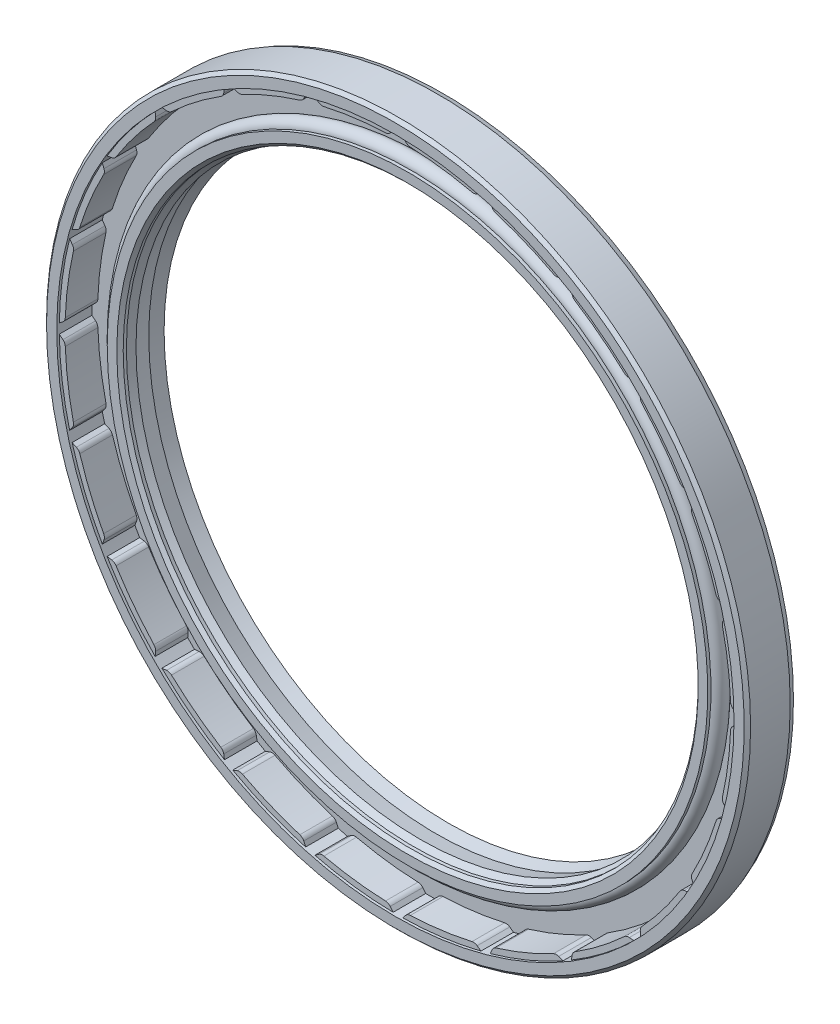
from build123d import *

# Parameters (mm, degrees)
CUT_EXTRUDE1_START       = -5.5
CUT_EXTRUDE1_DEPTH       = 5.5
FILLET3_R                = 1
CIRPATTERN1_COUNT        = 24
FILLET3_OF_CIRPATTERN1_R = 1
BOSS_EXTRUDE1_DEPTH      = 0.1


with BuildPart() as part:
    # Sketch1 → Revolve1 (revolve)
    with BuildSketch(Plane(origin=(0, 0, 0), x_dir=(0, 0, -1), z_dir=(1, 0, 0)), mode=Mode.PRIVATE) as revolve1_sk:
        with BuildLine():
            Line((0, 45.75), (0, 48))
            Line((0, 48), (-0.2, 48))
            Line((-0.2, 48), (-0.2, 52.5))
            Line((-0.2, 52.5), (0, 52.5))
            Line((0, 52.5), (0, 54.808823813))
            Line((0, 54.808823813), (-0.8, 55.1))
            Line((-0.8, 55.1), (-7, 55.1))
            Line((-7, 55.1), (-7.5, 54.6))
            Line((-7.5, 54.6), (-7.5, 53))
            Line((-7.5, 53), (-7.1, 53))
            Line((-7.1, 53), (-7.1, 52.1))
            Line((-7.1, 52.1), (-2, 52.1))
            Line((-2, 52.1), (-2, 47))
            Line((-2, 47), (-2.6, 47))
            ThreePointArc((-2.6, 47), (-3.85, 48.25), (-5.1, 47))
            Line((-5.1, 47), (-5.6, 47))
            Line((-5.6, 47), (-5.6, 45.5))
            Line((-5.6, 45.5), (-5.1, 45))
            Line((-5.1, 45), (-4.6, 45))
            Line((-4.6, 45), (-3.6, 44.5))
            Line((-3.6, 44.5), (-1.1, 45))
            Line((-1.1, 45), (0.8, 44.5))
            Line((0.8, 44.5), (0, 45.75))
        make_face()
    revolve(revolve1_sk.sketch.rotate(Axis((0, 0, 0), (0, 0, 1)), 90), axis=Axis((0, 0, 0), (0, 0, 1)))

    # Sketch2 → Cut-Extrude1 (cut)
    with BuildSketch(Plane.XY.offset(7.5).offset(CUT_EXTRUDE1_START)):
        with BuildLine():
            Line((-0.75, 52.994693131), (-1.5, 52.078402433))
            ThreePointArc((-1.5, 52.078402433), (0, 52.1), (1.5, 52.078402433))
            Line((1.5, 52.078402433), (0.75, 52.994693131))
            ThreePointArc((0.75, 52.994693131), (0, 53), (-0.75, 52.994693131))
        make_face()
    cut_extrude1 = extrude(amount=CUT_EXTRUDE1_DEPTH, mode=Mode.SUBTRACT)

    # Fillet3
    fillet3_edges = [part.edges().sort_by_distance(p)[0] for p in [
        (1.5, 52.078402433, 4.55),
        (-1.5, 52.078402433, 4.55),
    ]]
    fillet(fillet3_edges, radius=FILLET3_R)

    # CirPattern1: Cut-Extrude1 ×24 about axis
    cirpattern1_axis = Axis((0, 0, 0), (0, 0, 1))
    for i in range(1, CIRPATTERN1_COUNT):
        add(cut_extrude1.rotate(cirpattern1_axis, i * 360 / CIRPATTERN1_COUNT), mode=Mode.SUBTRACT)

    # Fillet3 of CirPattern1
    fillet3_of_cirpattern1_edges = [part.edges().sort_by_distance(p)[0] for p in [
        (-12.029993649, 50.69210247, 4.55),
        (-14.927771128, 49.915645335, 4.55),
        (-24.740163111, 45.851219496, 4.55),
        (-27.338239322, 44.351219496, 4.55),
        (-35.764331342, 37.885651686, 4.55),
        (-37.885651686, 35.764331342, 4.55),
        (-44.351219496, 27.338239322, 4.55),
        (-45.851219496, 24.740163111, 4.55),
        (-49.915645335, 14.927771128, 4.55),
        (-50.69210247, 12.029993649, 4.55),
        (-52.078402433, 1.5, 4.55),
        (-52.078402433, -1.5, 4.55),
        (-50.69210247, -12.029993649, 4.55),
        (-49.915645335, -14.927771128, 4.55),
        (-45.851219496, -24.740163111, 4.55),
        (-44.351219496, -27.338239322, 4.55),
        (-37.885651686, -35.764331342, 4.55),
        (-35.764331342, -37.885651686, 4.55),
        (-27.338239322, -44.351219496, 4.55),
        (-24.740163111, -45.851219496, 4.55),
        (-14.927771128, -49.915645335, 4.55),
        (-12.029993649, -50.69210247, 4.55),
        (-1.5, -52.078402433, 4.55),
        (1.5, -52.078402433, 4.55),
        (12.029993649, -50.69210247, 4.55),
        (14.927771128, -49.915645335, 4.55),
        (24.740163111, -45.851219496, 4.55),
        (27.338239322, -44.351219496, 4.55),
        (35.764331342, -37.885651686, 4.55),
        (37.885651686, -35.764331342, 4.55),
        (44.351219496, -27.338239322, 4.55),
        (45.851219496, -24.740163111, 4.55),
        (49.915645335, -14.927771128, 4.55),
        (50.69210247, -12.029993649, 4.55),
        (52.078402433, -1.5, 4.55),
        (52.078402433, 1.5, 4.55),
        (50.69210247, 12.029993649, 4.55),
        (49.915645335, 14.927771128, 4.55),
        (45.851219496, 24.740163111, 4.55),
        (44.351219496, 27.338239322, 4.55),
        (37.885651686, 35.764331342, 4.55),
        (35.764331342, 37.885651686, 4.55),
        (27.338239322, 44.351219496, 4.55),
        (24.740163111, 45.851219496, 4.55),
        (14.927771128, 49.915645335, 4.55),
        (12.029993649, 50.69210247, 4.55),
    ]]
    fillet(fillet3_of_cirpattern1_edges, radius=FILLET3_OF_CIRPATTERN1_R)

    # Sketch3 → Boss-Extrude1 (add)
    # profile 1 of 30: a face of its own
    with BuildSketch(Plane(origin=(0, 0, 0.2), x_dir=(-1, 0, 0), z_dir=(0, 0, -1))):
        with BuildLine():
            Line((-51.050080128, -0.665064103), (-50.921875, -0.458233173))
            Line((-50.921875, -0.458233173), (-49.891726763, -1.110276442))
            add(Edge.make_bspline(
                [(-49.891726763, -1.110276442), (-49.89892151, -1.088340377), (-49.913010225, -1.045385296), (-49.927728645, -0.980851455), (-49.937860812, -0.918439408), (-49.93983769, -0.877439507), (-49.940805288, -0.857371795)],
                knots=[0, 0, 0, 0, 1.070697403, 2.096633717, 3.068382936, 4, 4, 4, 4], degree=3))
            add(Edge.make_bspline(
                [(-49.940805288, -0.857371795), (-49.940603365, -0.833142611), (-49.940205123, -0.785356856), (-49.931566511, -0.715008412), (-49.916081487, -0.647307287), (-49.893126516, -0.582598811), (-49.864809129, -0.520011824), (-49.828743056, -0.460567343), (-49.786072509, -0.403910748), (-49.737011048, -0.350694425), (-49.683622553, -0.301484387), (-49.626201142, -0.258036194), (-49.565300634, -0.221200737), (-49.500974143, -0.191394634), (-49.433909359, -0.16688203), (-49.363391947, -0.149524736), (-49.289614042, -0.138242916), (-49.23922335, -0.136235459), (-49.213641827, -0.135216346)],
                knots=[0, 0, 0, 0, 1.017695887, 2.007140081, 2.972103751, 3.930644239, 4.888131427, 5.854318571, 6.846371115, 7.864357163, 8.89225577, 9.894133544, 10.885590498, 11.877394923, 12.869422657, 13.881881402, 14.924708187, 16, 16, 16, 16], degree=3))
            add(Edge.make_bspline(
                [(-49.213641827, -0.135216346), (-49.178690523, -0.135846558), (-49.110036988, -0.137084461), (-49.009369177, -0.153878939), (-48.913890179, -0.183670121), (-48.823970271, -0.225909588), (-48.740868537, -0.279572303), (-48.665007937, -0.343722423), (-48.598972821, -0.419658304), (-48.541541375, -0.504539112), (-48.49478529, -0.596361529), (-48.460279876, -0.693074216), (-48.438680841, -0.793512738), (-48.434832407, -0.861942643), (-48.432892628, -0.896434295)],
                knots=[0, 0, 0, 0, 1.035054604, 2.033118914, 3.012764064, 3.991096377, 4.968276945, 5.936965325, 6.925590588, 7.941101601, 8.967832747, 9.970973806, 10.977282432, 12, 12, 12, 12], degree=3))
            add(Edge.make_bspline(
                [(-48.432892628, -0.896434295), (-48.433525607, -0.93022062), (-48.434774618, -0.996888677), (-48.451811467, -1.095334361), (-48.481532443, -1.189932635), (-48.523566583, -1.280082358), (-48.577101814, -1.363502823), (-48.640725732, -1.439155542), (-48.714979516, -1.50520983), (-48.798604995, -1.560669419), (-48.887984727, -1.606472957), (-48.982347577, -1.638786172), (-49.079416265, -1.661081859), (-49.145744812, -1.664465162), (-49.179086538, -1.666165865)],
                knots=[0, 0, 0, 0, 1.01864178, 2.010010466, 3.002658338, 4.003340162, 5.002524508, 5.98556373, 6.977508254, 7.990503639, 9.006600931, 9.999197667, 10.994245957, 12, 12, 12, 12], degree=3))
            add(Edge.make_bspline(
                [(-49.179086538, -1.666165865), (-49.204991587, -1.665832436), (-49.257831423, -1.665152322), (-49.337941976, -1.654560105), (-49.420206913, -1.636949747), (-49.489716041, -1.615621012), (-49.547210874, -1.594500425), (-49.592940917, -1.575523152), (-49.640356774, -1.552555244), (-49.69051007, -1.52779264), (-49.74264247, -1.499474484), (-49.797145159, -1.468541116), (-49.853755038, -1.434475537), (-49.891782966, -1.410179158), (-49.911258013, -1.397736378)],
                knots=[0, 0, 0, 0, 1.17731635, 2.401431602, 3.667074428, 4.999942539, 5.703675741, 6.452328518, 7.250354027, 8.09912524, 8.995839072, 9.94782595, 10.949030659, 12, 12, 12, 12], degree=3))
            Line((-49.911258013, -1.397736378), (-51.050080128, -0.665064103))
        make_face()
        with BuildLine():
            add(Edge.make_bspline(
                [(-49.720953526, -0.910456731), (-49.720119856, -0.928348063), (-49.718483472, -0.963466413), (-49.710298394, -1.015157859), (-49.697338245, -1.064638829), (-49.679604785, -1.112057642), (-49.657699405, -1.157426926), (-49.630113826, -1.200321203), (-49.598188459, -1.241315991), (-49.561717476, -1.279630855), (-49.522107973, -1.314512458), (-49.479771613, -1.34449924), (-49.436107708, -1.370491051), (-49.390129815, -1.39095456), (-49.342416003, -1.407215118), (-49.292696063, -1.418122499), (-49.241178853, -1.424259702), (-49.206313356, -1.424604494), (-49.188601763, -1.424779647)],
                knots=[0, 0, 0, 0, 1.043122693, 2.047513766, 3.043246337, 4.019010392, 4.993561384, 5.97319715, 6.985097793, 8.017276424, 9.051378627, 10.05558124, 11.036616728, 12.007568168, 12.982750141, 13.969316698, 14.968417487, 16, 16, 16, 16], degree=3))
            add(Edge.make_bspline(
                [(-49.188601763, -1.424779647), (-49.170880595, -1.423928968), (-49.135935977, -1.422251502), (-49.084690826, -1.414284371), (-49.035651723, -1.400948852), (-48.988595429, -1.383588105), (-48.943562197, -1.36134661), (-48.900769419, -1.334122321), (-48.86023192, -1.3018234), (-48.821879047, -1.265593406), (-48.787112674, -1.225764578), (-48.75651454, -1.183758213), (-48.73045738, -1.139809228), (-48.710228317, -1.093571374), (-48.693747949, -1.045600534), (-48.682956535, -0.995510555), (-48.676797935, -0.943502535), (-48.676455823, -0.908303553), (-48.676282051, -0.890424679)],
                knots=[0, 0, 0, 0, 1.033509015, 2.037990855, 3.015006321, 3.990858558, 4.956766786, 5.936491083, 6.94083157, 7.97310348, 9.007299135, 10.017278333, 10.998402478, 11.978319977, 12.953590078, 13.949745249, 14.958599226, 16, 16, 16, 16], degree=3))
            add(Edge.make_bspline(
                [(-48.676282051, -0.890424679), (-48.677133674, -0.872703984), (-48.678813002, -0.837760298), (-48.686766597, -0.786508372), (-48.700151876, -0.737494175), (-48.717354167, -0.69027547), (-48.74032613, -0.645523394), (-48.767399072, -0.60257215), (-48.799748822, -0.562058203), (-48.835973203, -0.523709791), (-48.875596109, -0.489054932), (-48.917515818, -0.458727635), (-48.961144926, -0.432917804), (-49.007101191, -0.412424576), (-49.054820816, -0.396172005), (-49.104539176, -0.385262454), (-49.156056812, -0.379125836), (-49.19092225, -0.378780963), (-49.208633814, -0.378605769)],
                knots=[0, 0, 0, 0, 1.036553981, 2.043995266, 3.023889254, 4.002616586, 4.97573428, 5.958345081, 6.965644596, 8.000957827, 9.038200471, 10.037528768, 11.02154354, 11.995443641, 12.973587123, 13.963149762, 14.965284698, 16, 16, 16, 16], degree=3))
            add(Edge.make_bspline(
                [(-49.208633814, -0.378605769), (-49.226354887, -0.379456598), (-49.261299319, -0.381134358), (-49.312545823, -0.389099351), (-49.361579956, -0.402442725), (-49.408654633, -0.41977442), (-49.453746208, -0.44218672), (-49.496908967, -0.469093019), (-49.537483583, -0.501589202), (-49.575887125, -0.537767746), (-49.61043824, -0.57758766), (-49.641409353, -0.619166058), (-49.66706732, -0.663004723), (-49.687787859, -0.708815169), (-49.703230727, -0.756751724), (-49.714342468, -0.806346712), (-49.720421557, -0.857883741), (-49.720774322, -0.892746519), (-49.720953526, -0.910456731)],
                knots=[0, 0, 0, 0, 1.036128986, 2.043157213, 3.022649438, 4.000975484, 4.969332314, 5.959786733, 6.966673248, 8.001561993, 9.03837936, 10.043043113, 11.026654433, 12.000155228, 12.974827974, 13.963984885, 14.965708938, 16, 16, 16, 16], degree=3))
        make_face(mode=Mode.SUBTRACT)
    # profile 2 of 30: a face of its own
    with BuildSketch(Plane(origin=(0, 0, 0.2), x_dir=(-1, 0, 0), z_dir=(0, 0, -1))):
        with BuildLine():
            add(Edge.make_bspline(
                [(-49.715267556, -1.962209122), (-49.675378828, -1.960315214), (-49.597967442, -1.956639738), (-49.485222669, -1.954984197), (-49.379152412, -1.957523918), (-49.279913698, -1.963370762), (-49.187272945, -1.972620259), (-49.101706637, -1.98617026), (-49.022635151, -2.002863008), (-48.950168165, -2.024154663), (-48.882879483, -2.04849978), (-48.819827408, -2.07524062), (-48.760875987, -2.105584914), (-48.705710331, -2.138517844), (-48.654387735, -2.174584111), (-48.607380028, -2.213988626), (-48.563217702, -2.255241107), (-48.524597314, -2.30077285), (-48.488916006, -2.347495178), (-48.457598038, -2.396322362), (-48.431150477, -2.447083779), (-48.408545377, -2.499298836), (-48.389757937, -2.553108666), (-48.375851147, -2.608767312), (-48.366225353, -2.666061944), (-48.363151455, -2.704865251), (-48.361601691, -2.724428674)],
                knots=[0, 0, 0, 0, 1.645435872, 3.193269786, 4.645072472, 6.016410408, 7.288812001, 8.479633347, 9.584615265, 10.616412829, 11.589030649, 12.531982987, 13.436440512, 14.318840267, 15.177652927, 16.01786255, 16.844961271, 17.664185146, 18.474494838, 19.266376596, 20.050965005, 20.830440852, 21.609218311, 22.396666071, 23.191648816, 24, 24, 24, 24], degree=3))
            add(Edge.make_bspline(
                [(-48.361601691, -2.724428674), (-48.361006526, -2.744291567), (-48.359825513, -2.783706425), (-48.362668053, -2.842537861), (-48.370962332, -2.900061862), (-48.382854958, -2.956548792), (-48.399522708, -3.011791404), (-48.42049422, -3.065938351), (-48.446325133, -3.118745099), (-48.476176992, -3.170322013), (-48.5109705, -3.219840226), (-48.549642984, -3.267816633), (-48.593095694, -3.313335401), (-48.641643143, -3.355770074), (-48.693917922, -3.396740823), (-48.750957756, -3.434977753), (-48.812355823, -3.471363116), (-48.878699253, -3.504741945), (-48.95012801, -3.536295134), (-49.027757415, -3.563448929), (-49.111392384, -3.587519084), (-49.201179822, -3.608396565), (-49.297231987, -3.626455481), (-49.399546562, -3.640631015), (-49.507747332, -3.652437796), (-49.582029466, -3.657056547), (-49.620115313, -3.659424667)],
                knots=[0, 0, 0, 0, 0.81312046, 1.613512529, 2.406758097, 3.189310658, 3.9739183, 4.765603026, 5.563103211, 6.377485569, 7.201921883, 8.037381164, 8.897505495, 9.773518825, 10.674123092, 11.613986073, 12.581815106, 13.593155885, 14.651738095, 15.775385969, 16.955955313, 18.212092491, 19.546691454, 20.954427566, 22.438477724, 24, 24, 24, 24], degree=3))
            add(Edge.make_bspline(
                [(-49.620115313, -3.659424667), (-49.658168563, -3.661159577), (-49.732245752, -3.664536876), (-49.840652576, -3.665609829), (-49.943409312, -3.662769295), (-50.040466303, -3.655696166), (-50.131776591, -3.645494844), (-50.217215275, -3.630952708), (-50.29692573, -3.612721427), (-50.370842321, -3.589853578), (-50.440138881, -3.564261653), (-50.504934242, -3.535259201), (-50.565688014, -3.503740044), (-50.622425273, -3.469533135), (-50.67476042, -3.431912317), (-50.723669061, -3.391999331), (-50.767942603, -3.348637707), (-50.807834078, -3.302523976), (-50.844097076, -3.254508774), (-50.875651738, -3.204358879), (-50.902715123, -3.152514495), (-50.925934686, -3.099395763), (-50.944548311, -3.04461328), (-50.958448227, -2.98811842), (-50.968807769, -2.93007825), (-50.971782002, -2.890567551), (-50.973280377, -2.870662648)],
                knots=[0, 0, 0, 0, 1.560210594, 3.037217932, 4.439547474, 5.76951163, 7.022230478, 8.201432104, 9.317675475, 10.368859861, 11.368428328, 12.341786937, 13.274576059, 14.170497929, 15.052800216, 15.912531016, 16.753874283, 17.587513495, 18.408037955, 19.216189755, 20.011394427, 20.801496949, 21.588575767, 22.377967871, 23.182844326, 24, 24, 24, 24], degree=3))
            add(Edge.make_bspline(
                [(-50.973280377, -2.870662648), (-50.973894633, -2.850964343), (-50.975108258, -2.812045188), (-50.972026324, -2.754101772), (-50.964629833, -2.69746992), (-50.952352842, -2.642130743), (-50.936422037, -2.58779708), (-50.915847131, -2.534685692), (-50.890742708, -2.482912521), (-50.860958476, -2.432881544), (-50.827628799, -2.38415392), (-50.78937789, -2.337927258), (-50.746462479, -2.294468968), (-50.700063975, -2.252581743), (-50.648444173, -2.214077378), (-50.592807978, -2.177660762), (-50.533240941, -2.142823474), (-50.468557234, -2.111246893), (-50.398254969, -2.081889612), (-50.321360222, -2.055442153), (-50.237086802, -2.032708267), (-50.146272447, -2.012027185), (-50.048215467, -1.995482062), (-49.943567754, -1.980660755), (-49.831745025, -1.969994665), (-49.754844375, -1.964854501), (-49.715267556, -1.962209122)],
                knots=[0, 0, 0, 0, 0.812760042, 1.605820146, 2.390855826, 3.166225981, 3.941963059, 4.724669296, 5.513171201, 6.312782678, 7.124666932, 7.946479843, 8.784126331, 9.642577356, 10.522715709, 11.437650874, 12.384981295, 13.367480441, 14.404739787, 15.526359571, 16.719289077, 18.00409871, 19.367286611, 20.820419384, 22.363633011, 24, 24, 24, 24], degree=3))
        make_face()
        with BuildLine():
            add(Edge.make_bspline(
                [(-49.706753935, -2.198086526), (-49.740817438, -2.20029502), (-49.806658747, -2.204563816), (-49.902231097, -2.21286486), (-49.991092669, -2.223783131), (-50.073524483, -2.23705532), (-50.149582024, -2.250925588), (-50.218773953, -2.268332081), (-50.281730135, -2.28636426), (-50.338346102, -2.307645313), (-50.389845802, -2.331244368), (-50.4381694, -2.355235801), (-50.482383303, -2.382716025), (-50.523566359, -2.411757569), (-50.561702751, -2.442551081), (-50.596085668, -2.476031773), (-50.626984218, -2.511441109), (-50.663308499, -2.560284866), (-50.700099199, -2.623924936), (-50.731414992, -2.703315999), (-50.748242531, -2.784801838), (-50.748027357, -2.839376565), (-50.7479198, -2.866656238)],
                knots=[0, 0, 0, 0, 1.48028922, 2.861249432, 4.159648323, 5.361719656, 6.481940183, 7.510836921, 8.454558558, 9.320494112, 10.130518827, 10.910785577, 11.658222775, 12.385330305, 13.095371656, 13.781387702, 14.463765395, 15.131234416, 16.418872321, 17.638214996, 18.819440344, 20, 20, 20, 20], degree=3))
            add(Edge.make_bspline(
                [(-50.7479198, -2.866656238), (-50.745292795, -2.89390243), (-50.740064068, -2.948132588), (-50.713382718, -3.026445163), (-50.674997917, -3.101330641), (-50.632354165, -3.159872695), (-50.59137629, -3.203249013), (-50.557308307, -3.234537874), (-50.519555342, -3.263153151), (-50.47827623, -3.289007238), (-50.434236689, -3.313171056), (-50.386866828, -3.334730254), (-50.336189907, -3.353885559), (-50.300781715, -3.364190962), (-50.282675409, -3.369460725)],
                knots=[0, 0, 0, 0, 1.339405947, 2.66592107, 4.028971846, 5.459537202, 6.201421053, 6.9553309, 7.727102341, 8.522599767, 9.343837328, 10.190706365, 11.074800965, 12, 12, 12, 12], degree=3))
            add(Edge.make_bspline(
                [(-50.282675409, -3.369460725), (-50.259697889, -3.375710265), (-50.212864378, -3.388448277), (-50.140132419, -3.403351158), (-50.064200792, -3.414667911), (-49.985154059, -3.423042636), (-49.903000275, -3.429284234), (-49.817443168, -3.431665354), (-49.728753594, -3.430478354), (-49.668687681, -3.427875581), (-49.638144159, -3.426552071)],
                knots=[0, 0, 0, 0, 0.879007939, 1.791621934, 2.73911655, 3.712419711, 4.725912509, 5.780296996, 6.871280824, 8, 8, 8, 8], degree=3))
            add(Edge.make_bspline(
                [(-49.638144159, -3.426552071), (-49.6075855, -3.424524576), (-49.547906105, -3.420564988), (-49.460641304, -3.412373273), (-49.377871442, -3.400549541), (-49.299500229, -3.387250305), (-49.225430497, -3.371780885), (-49.155739658, -3.353748138), (-49.090263964, -3.333513619), (-49.029361054, -3.310251795), (-48.972787108, -3.285157531), (-48.920042478, -3.258871026), (-48.871683513, -3.230222949), (-48.827795438, -3.199560993), (-48.787237959, -3.168090072), (-48.751073271, -3.134387215), (-48.718895465, -3.098976246), (-48.682815221, -3.049853081), (-48.645558805, -2.986873698), (-48.615397036, -2.907764885), (-48.597444474, -2.82741358), (-48.597801545, -2.773428632), (-48.597979896, -2.74646393)],
                knots=[0, 0, 0, 0, 1.329799677, 2.597026247, 3.804575523, 4.95927978, 6.048229555, 7.088999651, 8.083959534, 9.022256268, 9.917924906, 10.770467244, 11.579727499, 12.355847901, 13.093939917, 13.806830148, 14.499687585, 15.167996228, 16.450983263, 17.66248539, 18.832445191, 20, 20, 20, 20], degree=3))
            add(Edge.make_bspline(
                [(-48.597979896, -2.74646393), (-48.6008179, -2.719224452), (-48.606502588, -2.664662195), (-48.633344385, -2.585675448), (-48.672907303, -2.51019392), (-48.716637009, -2.45161063), (-48.757504335, -2.407188531), (-48.792059101, -2.37573161), (-48.829764885, -2.346637314), (-48.870542228, -2.319865841), (-48.914815506, -2.296075004), (-48.961860057, -2.273908586), (-49.012228548, -2.254358819), (-49.066231667, -2.237221221), (-49.124930943, -2.222660566), (-49.189279699, -2.210583708), (-49.260051706, -2.201936153), (-49.337218735, -2.195308488), (-49.420766527, -2.192165289), (-49.510613158, -2.191040264), (-49.606636991, -2.193225573), (-49.672705948, -2.196433403), (-49.706753935, -2.198086526)],
                knots=[0, 0, 0, 0, 1.18508832, 2.373800772, 3.591893331, 4.870988693, 5.532143088, 6.208863569, 6.895549088, 7.596636218, 8.32264523, 9.074355305, 9.85176023, 10.664915767, 11.530929258, 12.474153866, 13.503666371, 14.623013582, 15.833611313, 17.130140616, 18.521046213, 20, 20, 20, 20], degree=3))
        make_face(mode=Mode.SUBTRACT)
    # profile 3 of 30: a face of its own
    with BuildSketch(Plane(origin=(0, 0, 0.2), x_dir=(-1, 0, 0), z_dir=(0, 0, -1))):
        Polygon((-49.807864802, -3.861539762), (-49.726234193, -4.791527742), (-49.93206352, -4.809556589), (-50.013694129, -3.879568608), align=None)
    # profile 4 of 30: a face of its own
    with BuildSketch(Plane(origin=(0, 0, 0.2), x_dir=(-1, 0, 0), z_dir=(0, 0, -1))):
        Polygon((-48.217151033, -5.335889879), (-48.160560488, -5.820164719), (-50.624001994, -6.10962786), (-50.652547668, -5.864736033), (-48.430492379, -5.603818565), (-48.476065296, -5.217199976), align=None)
    # profile 5 of 30: a face of its own
    with BuildSketch(Plane(origin=(0, 0, 0.2), x_dir=(-1, 0, 0), z_dir=(0, 0, -1))):
        Polygon((-47.967841467, -7.149401516), (-47.892220473, -7.633676356), (-50.35566198, -8.019794144), (-50.394223678, -7.774902317), (-48.17216839, -7.426845426), (-48.232765345, -7.040226837), align=None)
    # profile 6 of 30: a face of its own
    with BuildSketch(Plane(origin=(0, 0, 0.2), x_dir=(-1, 0, 0), z_dir=(0, 0, -1))):
        with BuildLine():
            add(Edge.make_bspline(
                [(-48.994344792, -8.672037405), (-48.955156566, -8.664784967), (-48.879125, -8.650714052), (-48.767718298, -8.634188946), (-48.662501304, -8.621987916), (-48.563438142, -8.614454659), (-48.470683793, -8.610998528), (-48.384280808, -8.613303859), (-48.303911479, -8.618640727), (-48.229422361, -8.630118791), (-48.159449483, -8.644521602), (-48.093635251, -8.663120738), (-48.031058754, -8.684749395), (-47.971831077, -8.709389031), (-47.916686385, -8.739006166), (-47.864368052, -8.7706274), (-47.816053913, -8.806671496), (-47.77112609, -8.845449589), (-47.729995781, -8.88733289), (-47.6921141, -8.931123283), (-47.659500649, -8.978111398), (-47.629086607, -9.026185231), (-47.604740705, -9.077499945), (-47.582572067, -9.130188069), (-47.565695543, -9.185665935), (-47.557293577, -9.223693281), (-47.553038702, -9.242950867)],
                knots=[0, 0, 0, 0, 1.645364279, 3.19227573, 4.649088324, 6.01768168, 7.293434579, 8.479237188, 9.585108418, 10.616382718, 11.588300088, 12.533153864, 13.437732157, 14.32102765, 15.178119699, 16.019775447, 16.842739037, 17.663593015, 18.46775487, 19.264677221, 20.050675734, 20.827310998, 21.610251434, 22.392281227, 23.185828482, 24, 24, 24, 24], degree=3))
            add(Edge.make_bspline(
                [(-47.553038702, -9.242950867), (-47.549783386, -9.262613181), (-47.543352791, -9.301454385), (-47.538134012, -9.360030103), (-47.538273349, -9.417989367), (-47.542805857, -9.475582965), (-47.551761754, -9.532534708), (-47.565413737, -9.588944168), (-47.583515663, -9.644689254), (-47.606119052, -9.699750625), (-47.632906487, -9.75395472), (-47.665400605, -9.806070153), (-47.70185059, -9.856910045), (-47.743803246, -9.905594204), (-47.790482279, -9.952603379), (-47.841721543, -9.998177749), (-47.897361305, -10.042445746), (-47.958285246, -10.084526884), (-48.0246953, -10.125102462), (-48.098034964, -10.162083245), (-48.17712779, -10.198083153), (-48.263448261, -10.230112916), (-48.355727641, -10.261548058), (-48.455088264, -10.288957441), (-48.560491742, -10.315499546), (-48.633364765, -10.330163868), (-48.670827164, -10.337702469)],
                knots=[0, 0, 0, 0, 0.817084689, 1.614080244, 2.408130716, 3.190918755, 3.980946296, 4.769578789, 5.568365512, 6.381915696, 7.208465222, 8.044372423, 8.897425094, 9.771316112, 10.676471076, 11.612171164, 12.58180933, 13.590109786, 14.646677801, 15.770239627, 16.955972703, 18.208225535, 19.543823823, 20.952352021, 22.433272042, 24, 24, 24, 24], degree=3))
            add(Edge.make_bspline(
                [(-48.670827164, -10.337702469), (-48.708178243, -10.344619373), (-48.781023918, -10.358109387), (-48.888235116, -10.373836635), (-48.990363456, -10.384041708), (-49.08721865, -10.391167523), (-49.17881604, -10.392323148), (-49.265268663, -10.390355534), (-49.346557068, -10.382781134), (-49.422976409, -10.370774854), (-49.494862314, -10.35469672), (-49.56287621, -10.334988865), (-49.62731963, -10.312397811), (-49.687739524, -10.285271691), (-49.74515174, -10.256258553), (-49.798165456, -10.222262702), (-49.84809829, -10.185747931), (-49.894172634, -10.145708523), (-49.936051703, -10.102558229), (-49.974370154, -10.057606355), (-50.008016426, -10.00997739), (-50.038270218, -9.960669306), (-50.063604955, -9.908622587), (-50.086049641, -9.854997113), (-50.103531259, -9.798761496), (-50.111916064, -9.760181088), (-50.116139664, -9.740747341)],
                knots=[0, 0, 0, 0, 1.558460236, 3.039459345, 4.444052745, 5.768918161, 7.022466013, 8.201003356, 9.315298518, 10.369254146, 11.372893864, 12.335328058, 13.273350367, 14.17183219, 15.050997511, 15.909866269, 16.752329474, 17.587354182, 18.41072497, 19.21752076, 20.008135828, 20.801002352, 21.588198367, 22.380591432, 23.184270538, 24, 24, 24, 24], degree=3))
            add(Edge.make_bspline(
                [(-50.116139664, -9.740747341), (-50.119398718, -9.721419605), (-50.125862569, -9.683085901), (-50.131007038, -9.625505775), (-50.130928538, -9.56837248), (-50.126249081, -9.512000569), (-50.118140354, -9.45608814), (-50.103971221, -9.401222199), (-50.086912615, -9.346537973), (-50.064044058, -9.292925355), (-50.037115416, -9.240529896), (-50.005894252, -9.189455512), (-49.96964198, -9.140260469), (-49.928547133, -9.0929519), (-49.883352492, -9.04712215), (-49.833383714, -9.00340658), (-49.778851848, -8.961429771), (-49.71917037, -8.921110605), (-49.653857939, -8.882009518), (-49.580770764, -8.84653441), (-49.501171505, -8.811554276), (-49.413720617, -8.780137942), (-49.319569013, -8.74914715), (-49.217571177, -8.721681121), (-49.108677459, -8.694746944), (-49.033141465, -8.679743467), (-48.994344792, -8.672037405)],
                knots=[0, 0, 0, 0, 0.809766683, 1.60605236, 2.385548087, 3.167512266, 3.942139638, 4.716767009, 5.506481991, 6.30720732, 7.121690761, 7.939206583, 8.778067608, 9.643756384, 10.526644153, 11.435793444, 12.385065912, 13.368487841, 14.410754246, 15.52751597, 16.723153989, 18.002057256, 19.365475841, 20.818114591, 22.365725219, 24, 24, 24, 24], degree=3))
        make_face()
        with BuildLine():
            add(Edge.make_bspline(
                [(-48.95478149, -8.903908399), (-48.988200029, -8.910597092), (-49.052867656, -8.923540264), (-49.146161209, -8.944852134), (-49.232323002, -8.968231111), (-49.312227583, -8.99134093), (-49.385187638, -9.016414495), (-49.451705217, -9.042261862), (-49.511106454, -9.069789839), (-49.564557293, -9.098034759), (-49.612454835, -9.127834976), (-49.656240117, -9.158997986), (-49.696407566, -9.191591032), (-49.733269513, -9.225688378), (-49.766291447, -9.261814709), (-49.795933011, -9.299463631), (-49.822202057, -9.338483579), (-49.850881326, -9.391942783), (-49.879013839, -9.459735979), (-49.89873809, -9.542515717), (-49.905299489, -9.625142328), (-49.897618652, -9.678868009), (-49.893783894, -9.705691251)],
                knots=[0, 0, 0, 0, 1.481707463, 2.867226127, 4.159406185, 5.362725182, 6.482750433, 7.512410133, 8.463848821, 9.327503966, 10.139123733, 10.914465736, 11.662562666, 12.386615746, 13.095487368, 13.788047083, 14.468406543, 15.137406689, 16.42315058, 17.646590133, 18.825029633, 20, 20, 20, 20], degree=3))
            add(Edge.make_bspline(
                [(-49.893783894, -9.705691251), (-49.88737156, -9.732209438), (-49.874556065, -9.78520788), (-49.838306898, -9.859675909), (-49.789480323, -9.928366489), (-49.739265407, -9.980283576), (-49.693091444, -10.017857279), (-49.655025854, -10.04405511), (-49.613727169, -10.066845018), (-49.569935129, -10.087780658), (-49.522912778, -10.105033077), (-49.472855048, -10.119599328), (-49.419989278, -10.131579794), (-49.383504305, -10.137416544), (-49.36493774, -10.140386764)],
                knots=[0, 0, 0, 0, 1.336810832, 2.67170949, 4.036561485, 5.46292144, 6.203044239, 6.958048756, 7.728912742, 8.517450494, 9.339829847, 10.18562122, 11.076694339, 12, 12, 12, 12], degree=3))
            add(Edge.make_bspline(
                [(-49.36493774, -10.140386764), (-49.341259646, -10.143468062), (-49.293187263, -10.149723858), (-49.219447597, -10.154668804), (-49.14307241, -10.155315233), (-49.063878386, -10.153460363), (-48.981846805, -10.147860378), (-48.89700325, -10.138720993), (-48.809448678, -10.126331326), (-48.75041803, -10.115396976), (-48.72040649, -10.109837886)],
                knots=[0, 0, 0, 0, 0.883933971, 1.794604381, 2.734160002, 3.711031712, 4.726952571, 5.77740769, 6.870020597, 8, 8, 8, 8], degree=3))
            add(Edge.make_bspline(
                [(-48.72040649, -10.109837886), (-48.690483321, -10.103859258), (-48.631931875, -10.092160722), (-48.546877994, -10.071695885), (-48.466491304, -10.048896163), (-48.390675424, -10.025289303), (-48.319627528, -9.999395092), (-48.253035178, -9.972768272), (-48.191200897, -9.943598903), (-48.134060296, -9.912584206), (-48.081411358, -9.879866861), (-48.032797269, -9.846469151), (-47.988376079, -9.811965523), (-47.949021928, -9.77582337), (-47.913259027, -9.73906842), (-47.882543546, -9.700644417), (-47.855525492, -9.661248524), (-47.826106339, -9.607974805), (-47.798443698, -9.540235245), (-47.778363881, -9.458078307), (-47.771910635, -9.376076238), (-47.779578838, -9.322689733), (-47.783407292, -9.296035803)],
                knots=[0, 0, 0, 0, 1.326625194, 2.595842088, 3.802158249, 4.95905671, 6.0473037, 7.089132389, 8.076124514, 9.017973005, 9.914255522, 10.769885823, 11.581504161, 12.357283318, 13.091334923, 13.808838304, 14.49327636, 15.165796733, 16.451589769, 17.660958796, 18.832202233, 20, 20, 20, 20], degree=3))
            add(Edge.make_bspline(
                [(-47.783407292, -9.296035803), (-47.790044618, -9.269542119), (-47.803298709, -9.21663682), (-47.839207337, -9.141702198), (-47.889641605, -9.073317328), (-47.940208573, -9.0205623), (-47.987039414, -8.982509754), (-48.025160598, -8.955710472), (-48.066424382, -8.932131112), (-48.11064141, -8.911781496), (-48.157452052, -8.89364899), (-48.207089635, -8.878059456), (-48.259664121, -8.86568211), (-48.315506903, -8.856049002), (-48.375538012, -8.849507794), (-48.440929131, -8.846694572), (-48.512125912, -8.847320146), (-48.589302015, -8.851510717), (-48.672525291, -8.858925145), (-48.761438745, -8.870916457), (-48.856401297, -8.88507826), (-48.9212685, -8.897493954), (-48.95478149, -8.903908399)],
                knots=[0, 0, 0, 0, 1.184637112, 2.365604576, 3.58149495, 4.863890062, 5.528872413, 6.200937617, 6.886488868, 7.590666036, 8.314007989, 9.066475501, 9.84937177, 10.65905978, 11.527348893, 12.471293877, 13.501301345, 14.619830183, 15.828799274, 17.130636982, 18.51757238, 20, 20, 20, 20], degree=3))
        make_face(mode=Mode.SUBTRACT)
    # profile 7 of 30: a face of its own
    with BuildSketch(Plane(origin=(0, 0, 0.2), x_dir=(-1, 0, 0), z_dir=(0, 0, -1))):
        Polygon((-48.834431159, -10.566871891), (-48.630605038, -11.470818205), (-48.831426352, -11.515890321), (-49.035252473, -10.611944007), align=None)
    # profile 8 of 30: a face of its own
    with BuildSketch(Plane(origin=(0, 0, 0.2), x_dir=(-1, 0, 0), z_dir=(0, 0, -1))):
        Polygon((-47.132910208, -11.430035995), (-46.736776393, -12.963489521), (-49.548775592, -12.310444649), (-49.498695464, -12.085584873), (-47.061796425, -12.647984713), (-47.361275592, -11.489130546), align=None)
    # profile 9 of 30: a face of its own
    with BuildSketch(Plane(origin=(0, 0, 0.2), x_dir=(-1, 0, 0), z_dir=(0, 0, -1))):
        with BuildLine():
            add(Edge.make_bspline(
                [(-48.628411405, -14.077358479), (-48.625407065, -14.090970223), (-48.619555544, -14.117481671), (-48.619319472, -14.158534031), (-48.62891082, -14.19822425), (-48.645319121, -14.236336265), (-48.6685925, -14.270532886), (-48.697725027, -14.29956278), (-48.733015304, -14.321391776), (-48.759245753, -14.330579025), (-48.772642174, -14.335271139)],
                knots=[0, 0, 0, 0, 1.016903673, 1.980612311, 2.969019796, 3.979758581, 4.998197645, 5.972960814, 6.964750049, 8, 8, 8, 8], degree=3))
            add(Edge.make_bspline(
                [(-48.772642174, -14.335271139), (-48.786248897, -14.338552868), (-48.813048631, -14.345016546), (-48.854429443, -14.344055347), (-48.894697837, -14.335393525), (-48.933024716, -14.318962847), (-48.967355439, -14.295451911), (-48.996515264, -14.266749241), (-49.018770907, -14.232326784), (-49.027573733, -14.206631598), (-49.032057239, -14.193544376)],
                knots=[0, 0, 0, 0, 1.019665952, 2.008329039, 2.994578542, 4.017016322, 5.035951593, 6.01978159, 6.99142369, 8, 8, 8, 8], degree=3))
            add(Edge.make_bspline(
                [(-49.032057239, -14.193544376), (-49.035348357, -14.179936113), (-49.041791139, -14.153296214), (-49.040764178, -14.112114601), (-49.032390573, -14.07199191), (-49.015031993, -14.034050185), (-48.991416298, -13.999937728), (-48.962160623, -13.971081365), (-48.92774918, -13.948323715), (-48.901604353, -13.939574177), (-48.888327271, -13.935130915)],
                knots=[0, 0, 0, 0, 1.018635487, 1.994107929, 2.979360737, 3.994487711, 5.019306724, 5.993559252, 6.981072682, 8, 8, 8, 8], degree=3))
            add(Edge.make_bspline(
                [(-48.888327271, -13.935130915), (-48.87455256, -13.931912226), (-48.847415118, -13.925571115), (-48.805876711, -13.925625485), (-48.765487977, -13.934514283), (-48.727605407, -13.951572723), (-48.69305321, -13.974722946), (-48.664554305, -14.0039998), (-48.641463878, -14.03800498), (-48.632822298, -14.064059538), (-48.628411405, -14.077358479)],
                knots=[0, 0, 0, 0, 1.028243031, 2.025732939, 2.996838895, 4.020755498, 5.036328267, 6.008348061, 6.983407799, 8, 8, 8, 8], degree=3))
        make_face()
    # profile 10 of 30: a face of its own
    with BuildSketch(Plane(origin=(0, 0, 0.2), x_dir=(-1, 0, 0), z_dir=(0, 0, -1))):
        with BuildLine():
            Line((-45.976878549, -15.465309264), (-46.202739928, -15.537424649))
            Line((-46.202739928, -15.537424649), (-46.472171017, -14.693073687))
            Line((-46.472171017, -14.693073687), (-47.156265569, -14.781214713))
            add(Edge.make_bspline(
                [(-47.156265569, -14.781214713), (-47.141243198, -14.804051765), (-47.112170935, -14.848247506), (-47.075343122, -14.915742644), (-47.043881707, -14.980548007), (-47.028822837, -15.024439843), (-47.021550024, -15.04563779)],
                knots=[0, 0, 0, 0, 1.101267766, 2.131244613, 3.097468219, 4, 4, 4, 4], degree=3))
            add(Edge.make_bspline(
                [(-47.021550024, -15.04563779), (-47.013622168, -15.072205686), (-46.998036359, -15.124436978), (-46.985000484, -15.203981562), (-46.978798526, -15.281884484), (-46.979896093, -15.358481455), (-46.990390624, -15.433601438), (-47.007743058, -15.507538156), (-47.033581006, -15.580009227), (-47.066981412, -15.650316359), (-47.107552482, -15.717027959), (-47.153416174, -15.77958164), (-47.206166841, -15.836010352), (-47.264580615, -15.887262522), (-47.328734683, -15.933675571), (-47.39947458, -15.973381989), (-47.475260167, -16.009088266), (-47.528992841, -16.027387669), (-47.556405793, -16.036723527)],
                knots=[0, 0, 0, 0, 1.053170526, 2.070486065, 3.057168985, 4.022055928, 4.976195916, 5.93524154, 6.904792817, 7.895570087, 8.889331051, 9.86927536, 10.839304295, 11.819659569, 12.820106345, 13.843481676, 14.899802869, 16, 16, 16, 16], degree=3))
            add(Edge.make_bspline(
                [(-47.556405793, -16.036723527), (-47.595085027, -16.047536632), (-47.671409981, -16.068873914), (-47.788667133, -16.083857704), (-47.905262292, -16.083120513), (-48.001250869, -16.070839409), (-48.07621048, -16.053369309), (-48.130677629, -16.037058997), (-48.182924454, -16.016798102), (-48.233097398, -15.993720875), (-48.281367887, -15.967858436), (-48.327177659, -15.937880332), (-48.371114483, -15.905051351), (-48.412944622, -15.868719334), (-48.452269446, -15.829391175), (-48.489045664, -15.787024955), (-48.523060296, -15.742047155), (-48.554235539, -15.694126631), (-48.582844264, -15.643443465), (-48.608676823, -15.589823816), (-48.632628924, -15.533676089), (-48.645588343, -15.49462439), (-48.652158998, -15.474824489)],
                knots=[0, 0, 0, 0, 1.744422733, 3.442234234, 5.118784594, 6.802201529, 7.6366822, 8.463234887, 9.271942266, 10.07081976, 10.863209204, 11.650329556, 12.448679389, 13.246138005, 14.056991967, 14.864689133, 15.683365746, 16.506693877, 17.348402345, 18.211827719, 19.093365084, 20, 20, 20, 20], degree=3))
            add(Edge.make_bspline(
                [(-48.652158998, -15.474824489), (-48.659320874, -15.451072231), (-48.67339807, -15.404385417), (-48.685880614, -15.333471504), (-48.69340609, -15.263841637), (-48.693638115, -15.195271277), (-48.688481453, -15.127454597), (-48.675627749, -15.060960965), (-48.65709242, -14.995359474), (-48.632144394, -14.931427796), (-48.600922144, -14.87022713), (-48.565739084, -14.811795233), (-48.524536528, -14.758122818), (-48.479697588, -14.707638638), (-48.428976547, -14.661957616), (-48.373874261, -14.619939417), (-48.314059103, -14.581415611), (-48.271259521, -14.559816541), (-48.249514767, -14.548842918)],
                knots=[0, 0, 0, 0, 1.073547467, 2.110136646, 3.112971309, 4.103481479, 5.075534562, 6.053938986, 7.031140634, 8.024654194, 9.020506208, 10.003786764, 10.974036782, 11.946708057, 12.92423059, 13.924873718, 14.945711434, 16, 16, 16, 16], degree=3))
            Line((-48.249514767, -14.548842918), (-48.171890569, -14.792232341))
            add(Edge.make_bspline(
                [(-48.171890569, -14.792232341), (-48.192187477, -14.804180106), (-48.231286933, -14.827195982), (-48.283819631, -14.867198859), (-48.328800018, -14.909490869), (-48.365547125, -14.955565206), (-48.395289433, -15.004629194), (-48.419236096, -15.057357623), (-48.436475878, -15.1143387), (-48.448409678, -15.174361229), (-48.454206591, -15.236178569), (-48.451783001, -15.29796368), (-48.443740897, -15.359247569), (-48.432472636, -15.398811857), (-48.426798421, -15.418734745)],
                knots=[0, 0, 0, 0, 1.148606114, 2.212646113, 3.215310537, 4.154322365, 5.079303953, 6.0091167, 6.972895933, 7.977907707, 8.99212368, 9.994755003, 10.990244159, 12, 12, 12, 12], degree=3))
            add(Edge.make_bspline(
                [(-48.426798421, -15.418734745), (-48.420201199, -15.437765999), (-48.407191839, -15.475294589), (-48.380650808, -15.528218899), (-48.349609396, -15.577364827), (-48.313892299, -15.622889911), (-48.272858898, -15.664124917), (-48.227184989, -15.701887459), (-48.176343041, -15.735335399), (-48.121572868, -15.76476553), (-48.06368397, -15.789099397), (-48.004139809, -15.808385647), (-47.943181786, -15.821038302), (-47.881233746, -15.826700669), (-47.818346955, -15.827569759), (-47.754497513, -15.821156171), (-47.689433821, -15.809262191), (-47.646454174, -15.796727672), (-47.624514767, -15.790329296)],
                knots=[0, 0, 0, 0, 0.981040816, 1.934558808, 2.878268228, 3.811143642, 4.749116387, 5.708761271, 6.695086944, 7.71088436, 8.73563914, 9.75221859, 10.757695424, 11.763402754, 12.780665991, 13.818775698, 14.886571427, 16, 16, 16, 16], degree=3))
            add(Edge.make_bspline(
                [(-47.624514767, -15.790329296), (-47.605005458, -15.783689072), (-47.566819191, -15.770691925), (-47.5131536, -15.745326762), (-47.463621188, -15.716680002), (-47.418275427, -15.684362042), (-47.378170467, -15.647055203), (-47.341111821, -15.607331606), (-47.309581247, -15.562566661), (-47.282132358, -15.514831527), (-47.259547884, -15.464186161), (-47.242367433, -15.411521396), (-47.231390842, -15.356885496), (-47.225975923, -15.300851305), (-47.225853542, -15.243124743), (-47.232244063, -15.183999937), (-47.243554648, -15.122906811), (-47.255701682, -15.082432068), (-47.261934639, -15.061663431)],
                knots=[0, 0, 0, 0, 1.078280185, 2.110556198, 3.101448723, 4.071774933, 5.018349413, 5.964923893, 6.910852523, 7.877866491, 8.844287793, 9.808928912, 10.772262471, 11.75588144, 12.752270958, 13.788940832, 14.865448404, 16, 16, 16, 16], degree=3))
            add(Edge.make_bspline(
                [(-47.261934639, -15.061663431), (-47.268018941, -15.043869493), (-47.280538497, -15.007255231), (-47.304957165, -14.952651604), (-47.334213215, -14.896670426), (-47.367649645, -14.838688396), (-47.407295383, -14.780062231), (-47.449881516, -14.718534113), (-47.498838619, -14.656713587), (-47.533591332, -14.615521607), (-47.55139778, -14.594415835)],
                knots=[0, 0, 0, 0, 0.815614087, 1.678274287, 2.591825467, 3.555839624, 4.580374935, 5.6615168, 6.801817926, 8, 8, 8, 8], degree=3))
            Line((-47.55139778, -14.594415835), (-46.304402588, -14.438666636))
            Line((-46.304402588, -14.438666636), (-45.976878549, -15.465309264))
        make_face()
    # profile 11 of 30: a face of its own
    with BuildSketch(Plane(origin=(0, 0, 0.2), x_dir=(-1, 0, 0), z_dir=(0, 0, -1))):
        Polygon((-45.398123951, -16.908544038), (-48.47204222, -16.903536025), (-48.558680842, -16.6596458), (-45.485764175, -16.662650608), align=None)
    # profile 12 of 30: a face of its own
    with BuildSketch(Plane(origin=(0, 0, 0.2), x_dir=(-1, 0, 0), z_dir=(0, 0, -1))):
        with BuildLine():
            add(Edge.make_bspline(
                [(-46.023338537, -18.581423779), (-46.025412929, -18.604158177), (-46.029452993, -18.64843543), (-46.039743859, -18.71273505), (-46.052098843, -18.773271633), (-46.067003651, -18.830229005), (-46.085130899, -18.88335904), (-46.105534867, -18.932952004), (-46.128443363, -18.978892564), (-46.163329263, -19.034069309), (-46.213153127, -19.096531015), (-46.283013752, -19.161643058), (-46.363706082, -19.215488869), (-46.423205211, -19.241994598), (-46.453526838, -19.255502305)],
                knots=[0, 0, 0, 0, 0.968293987, 1.885838377, 2.76090673, 3.588939873, 4.381787156, 5.140693389, 5.862853292, 6.556529135, 7.907056007, 9.240125123, 10.593527374, 12, 12, 12, 12], degree=3))
            add(Edge.make_bspline(
                [(-46.453526838, -19.255502305), (-46.475603719, -19.263574146), (-46.519215773, -19.279519767), (-46.586313959, -19.296407683), (-46.653464963, -19.30770991), (-46.721055735, -19.312023257), (-46.788798875, -19.31074501), (-46.856630883, -19.302413163), (-46.924717594, -19.288547759), (-46.969291466, -19.274594931), (-46.991888216, -19.267521536)],
                knots=[0, 0, 0, 0, 1.024689804, 2.024236441, 3.012984058, 3.990867616, 4.974076891, 5.963923102, 6.967809631, 8, 8, 8, 8], degree=3))
            add(Edge.make_bspline(
                [(-46.991888216, -19.267521536), (-47.019053863, -19.257150838), (-47.072983819, -19.236562657), (-47.148616516, -19.194280428), (-47.218780495, -19.143404718), (-47.283034086, -19.083265382), (-47.341975592, -19.014864774), (-47.394563895, -18.937282394), (-47.442619554, -18.851482329), (-47.468745739, -18.789539749), (-47.482172671, -18.757705831)],
                knots=[0, 0, 0, 0, 0.953809643, 1.893527961, 2.835370228, 3.793391942, 4.776796111, 5.793978953, 6.866267882, 8, 8, 8, 8], degree=3))
            add(Edge.make_bspline(
                [(-47.482172671, -18.757705831), (-47.493653767, -18.726477643), (-47.515939864, -18.665860219), (-47.540856388, -18.574693674), (-47.556165723, -18.486475829), (-47.561634164, -18.401197177), (-47.558899829, -18.319089552), (-47.5470833, -18.239958996), (-47.52514975, -18.164022121), (-47.494548403, -18.091928438), (-47.457410589, -18.024303432), (-47.416517172, -17.961551755), (-47.371500514, -17.9045033), (-47.323113606, -17.852624222), (-47.270117513, -17.807037923), (-47.213893698, -17.766534376), (-47.153407492, -17.732360623), (-47.110918372, -17.713838288), (-47.089544466, -17.704520735)],
                knots=[0, 0, 0, 0, 1.26822964, 2.461776378, 3.59818509, 4.676156795, 5.71436457, 6.725287932, 7.718502796, 8.719781893, 9.705277698, 10.656827873, 11.572379609, 12.472940304, 13.357340431, 14.233409784, 15.111326997, 16, 16, 16, 16], degree=3))
            add(Edge.make_bspline(
                [(-47.089544466, -17.704520735), (-47.057607951, -17.69315861), (-46.994850212, -17.670831151), (-46.896674426, -17.65506683), (-46.798596083, -17.653920693), (-46.717057936, -17.665786611), (-46.652052146, -17.68296324), (-46.602246467, -17.700785678), (-46.551573988, -17.722753168), (-46.500392574, -17.749963588), (-46.449045961, -17.782256326), (-46.396588853, -17.818476241), (-46.343465672, -17.859457778), (-46.308963433, -17.889786458), (-46.291267223, -17.905342049)],
                knots=[0, 0, 0, 0, 1.395438947, 2.742146105, 4.077670186, 5.426961101, 6.124909754, 6.847739322, 7.60611185, 8.400584641, 9.235340412, 10.106077228, 11.028606344, 12, 12, 12, 12], degree=3))
            add(Edge.make_bspline(
                [(-46.291267223, -17.905342049), (-46.287125415, -17.872620992), (-46.27910222, -17.809236244), (-46.253217664, -17.719700097), (-46.220223857, -17.637792611), (-46.176144686, -17.565447671), (-46.124449509, -17.501981035), (-46.065775588, -17.447911681), (-46.000815602, -17.402693775), (-45.952795523, -17.381584813), (-45.928687095, -17.370987081)],
                knots=[0, 0, 0, 0, 1.16143951, 2.249852522, 3.276427076, 4.26683445, 5.224871431, 6.153892489, 7.073163713, 8, 8, 8, 8], degree=3))
            add(Edge.make_bspline(
                [(-45.928687095, -17.370987081), (-45.903194419, -17.362172728), (-45.852108841, -17.344509367), (-45.770533796, -17.332340686), (-45.685954259, -17.332142906), (-45.599104667, -17.343279194), (-45.512440198, -17.365509359), (-45.42840292, -17.399847206), (-45.349033955, -17.446487215), (-45.2745571, -17.503537244), (-45.206689011, -17.570021507), (-45.146687801, -17.644427435), (-45.095993809, -17.726595169), (-45.070278421, -17.785801212), (-45.057292864, -17.815698619)],
                knots=[0, 0, 0, 0, 0.895063249, 1.793645483, 2.72586256, 3.699042717, 4.696301944, 5.691691545, 6.706199078, 7.747204289, 8.802719188, 9.856482436, 10.917583186, 12, 12, 12, 12], degree=3))
            add(Edge.make_bspline(
                [(-45.057292864, -17.815698619), (-45.046658647, -17.845519813), (-45.025608966, -17.904548764), (-45.007972555, -17.996596257), (-45.001077446, -18.089263611), (-45.006949046, -18.181778068), (-45.023044736, -18.271834148), (-45.050418915, -18.357744352), (-45.088520034, -18.438192918), (-45.137288657, -18.51216835), (-45.193798793, -18.578377274), (-45.25734606, -18.635403498), (-45.326927052, -18.682727094), (-45.377917056, -18.705355162), (-45.40334655, -18.716640126)],
                knots=[0, 0, 0, 0, 1.063745637, 2.105609453, 3.141477865, 4.18222112, 5.215422218, 6.211749883, 7.20647781, 8.200206575, 9.183919973, 10.126441412, 11.065627726, 12, 12, 12, 12], degree=3))
            add(Edge.make_bspline(
                [(-45.40334655, -18.716640126), (-45.429164059, -18.725806008), (-45.479750809, -18.743765611), (-45.558598833, -18.756407088), (-45.637091039, -18.75841197), (-45.71546985, -18.746948892), (-45.793608989, -18.723358996), (-45.871291307, -18.68776542), (-45.949400289, -18.640916087), (-45.998080231, -18.601747157), (-46.023338537, -18.581423779)],
                knots=[0, 0, 0, 0, 0.980004715, 1.920218342, 2.847650823, 3.784203198, 4.745700986, 5.763134308, 6.839369228, 8, 8, 8, 8], degree=3))
        make_face()
        with BuildLine():
            add(Edge.make_bspline(
                [(-45.285658248, -17.893322818), (-45.292047319, -17.877995465), (-45.304591974, -17.847900891), (-45.328052644, -17.805766949), (-45.353458675, -17.76662654), (-45.381401384, -17.730711772), (-45.412905016, -17.699105526), (-45.446582347, -17.670492056), (-45.482567752, -17.644500294), (-45.521656009, -17.623626825), (-45.56120007, -17.605231599), (-45.601677687, -17.592354678), (-45.641724393, -17.583320398), (-45.681620757, -17.577912098), (-45.721335945, -17.578050082), (-45.760717024, -17.582796358), (-45.80013042, -17.591047072), (-45.825613533, -17.600211524), (-45.838542864, -17.604861279)],
                knots=[0, 0, 0, 0, 1.147930151, 2.253909547, 3.330126738, 4.374394839, 5.395155503, 6.411005014, 7.42993495, 8.458504683, 9.47159355, 10.443017766, 11.389971728, 12.309560987, 13.221870293, 14.128607744, 15.050514446, 16, 16, 16, 16], degree=3))
            add(Edge.make_bspline(
                [(-45.838542864, -17.604861279), (-45.851046791, -17.610236946), (-45.875953367, -17.620944739), (-45.910635711, -17.642373771), (-45.94278961, -17.667338309), (-45.971893454, -17.696458081), (-45.99950284, -17.728420006), (-46.023034031, -17.765479577), (-46.045364734, -17.80536199), (-46.064021152, -17.848728527), (-46.079575787, -17.893700918), (-46.09042767, -17.939530676), (-46.09787839, -17.985045867), (-46.099526125, -18.03054731), (-46.097756783, -18.075829055), (-46.091050966, -18.121090485), (-46.080251883, -18.166298307), (-46.069383828, -18.195569546), (-46.063903441, -18.210330029)],
                knots=[0, 0, 0, 0, 0.91635723, 1.825292194, 2.739158941, 3.654202595, 4.596446866, 5.579529859, 6.606886907, 7.675147572, 8.756894159, 9.81035528, 10.846364555, 11.860074182, 12.873783809, 13.897003873, 14.939531101, 16, 16, 16, 16], degree=3))
            add(Edge.make_bspline(
                [(-46.063903441, -18.210330029), (-46.055685591, -18.228928437), (-46.039391838, -18.265804002), (-46.006824351, -18.316855956), (-45.967747377, -18.363248995), (-45.923170771, -18.405250414), (-45.873105446, -18.440301305), (-45.820223873, -18.4696997), (-45.76366319, -18.49003236), (-45.705253153, -18.502954241), (-45.646826669, -18.508601054), (-45.590216253, -18.506274378), (-45.535998034, -18.498611417), (-45.502192097, -18.486667811), (-45.48547796, -18.480762722)],
                knots=[0, 0, 0, 0, 1.035185304, 2.052489927, 3.073204282, 4.120624271, 5.164062912, 6.180548922, 7.195288728, 8.215009755, 9.223308976, 10.176814864, 11.098591323, 12, 12, 12, 12], degree=3))
            add(Edge.make_bspline(
                [(-45.48547796, -18.480762722), (-45.474200582, -18.475782005), (-45.451630319, -18.465813722), (-45.419487778, -18.447383217), (-45.389861709, -18.425030381), (-45.362231709, -18.399862043), (-45.336383339, -18.371793648), (-45.313447608, -18.339701808), (-45.291893684, -18.304882021), (-45.272891619, -18.266931824), (-45.25726659, -18.226445037), (-45.246194932, -18.18379106), (-45.24018758, -18.139248048), (-45.239255148, -18.09322458), (-45.243476438, -18.045422214), (-45.252562432, -17.995982863), (-45.266691129, -17.944781421), (-45.27922894, -17.910765806), (-45.285658248, -17.893322818)],
                knots=[0, 0, 0, 0, 0.853468015, 1.70810972, 2.558989918, 3.418310353, 4.293962111, 5.195780922, 6.145529633, 7.127860063, 8.130524619, 9.145575989, 10.172344284, 11.236191897, 12.326838377, 13.490124412, 14.712951998, 16, 16, 16, 16], degree=3))
        make_face(mode=Mode.SUBTRACT)
        with BuildLine():
            add(Edge.make_bspline(
                [(-46.270233569, -18.295967049), (-46.27844366, -18.276795114), (-46.294597104, -18.239074121), (-46.323782783, -18.18556595), (-46.357227369, -18.136628073), (-46.394670281, -18.09201968), (-46.435950196, -18.051989562), (-46.480666106, -18.015386405), (-46.529940016, -17.984064444), (-46.582269224, -17.957117887), (-46.636193626, -17.935503055), (-46.690226272, -17.918570158), (-46.743920052, -17.907570212), (-46.797256246, -17.901829783), (-46.850381614, -17.902277707), (-46.902809403, -17.909148916), (-46.955212461, -17.920300166), (-46.988841402, -17.932634912), (-47.005910652, -17.938895735)],
                knots=[0, 0, 0, 0, 1.101865344, 2.167932137, 3.215325249, 4.229759059, 5.240502888, 6.250514811, 7.278403086, 8.320132558, 9.357218785, 10.345139565, 11.308930435, 12.249172768, 13.175612093, 14.109082682, 15.040215416, 16, 16, 16, 16], degree=3))
            add(Edge.make_bspline(
                [(-47.005910652, -17.938895735), (-47.026430779, -17.947977806), (-47.06735216, -17.966089338), (-47.123101322, -18.004073519), (-47.174478035, -18.048980403), (-47.219359516, -18.101780251), (-47.257893982, -18.160148543), (-47.286399085, -18.224237815), (-47.306815703, -18.292336471), (-47.317061416, -18.364552745), (-47.317801821, -18.439568695), (-47.309795648, -18.516764431), (-47.291575663, -18.59591496), (-47.272579583, -18.647879675), (-47.26282171, -18.674572818)],
                knots=[0, 0, 0, 0, 0.925344024, 1.845327573, 2.773673261, 3.737087792, 4.699218034, 5.652908373, 6.623895025, 7.627444712, 8.655063534, 9.715928032, 10.826721965, 12, 12, 12, 12], degree=3))
            add(Edge.make_bspline(
                [(-47.26282171, -18.674572818), (-47.254364666, -18.694958218), (-47.237885842, -18.734679829), (-47.207150838, -18.789901866), (-47.174605811, -18.84101494), (-47.137125079, -18.886078943), (-47.096976097, -18.926415015), (-47.053564245, -18.962010345), (-47.00633698, -18.991948653), (-46.956366866, -19.016793887), (-46.905078819, -19.036782114), (-46.853270298, -19.051496478), (-46.801714133, -19.060394476), (-46.750586128, -19.064511997), (-46.699704351, -19.063673192), (-46.64909573, -19.056870444), (-46.598585657, -19.045693653), (-46.566090237, -19.033696201), (-46.549680684, -19.027637722)],
                knots=[0, 0, 0, 0, 1.190460095, 2.319649912, 3.406959124, 4.456992349, 5.476574236, 6.475881522, 7.480861671, 8.488424491, 9.484190216, 10.44850732, 11.390802133, 12.303856428, 13.214238363, 14.131950562, 15.056671496, 16, 16, 16, 16], degree=3))
            add(Edge.make_bspline(
                [(-46.549680684, -19.027637722), (-46.533990491, -19.020791057), (-46.502989077, -19.007263098), (-46.459567351, -18.981252765), (-46.419245502, -18.951258497), (-46.382691018, -18.916271776), (-46.348806134, -18.877637737), (-46.318686312, -18.834246945), (-46.29220758, -18.786284689), (-46.26896277, -18.734916636), (-46.249933944, -18.681201489), (-46.236320041, -18.626518292), (-46.228459054, -18.571657084), (-46.225010743, -18.516651781), (-46.228497446, -18.461493129), (-46.236187695, -18.406056882), (-46.250552756, -18.350667156), (-46.263601382, -18.314400299), (-46.270233569, -18.295967049)],
                knots=[0, 0, 0, 0, 0.947053853, 1.871233154, 2.795551113, 3.724019186, 4.667457627, 5.636714204, 6.642226009, 7.697123495, 8.755376737, 9.793332715, 10.811635818, 11.820667635, 12.838928787, 13.866377946, 14.915550085, 16, 16, 16, 16], degree=3))
        make_face(mode=Mode.SUBTRACT)
    # profile 13 of 30: a face of its own
    with BuildSketch(Plane(origin=(0, 0, 0.2), x_dir=(-1, 0, 0), z_dir=(0, 0, -1))):
        with BuildLine():
            add(Edge.make_bspline(
                [(-46.521057574, -19.970982364), (-46.516118978, -19.984013887), (-46.50645897, -20.009503844), (-46.502288028, -20.050255438), (-46.505664168, -20.090985216), (-46.517974301, -20.130612557), (-46.536511899, -20.167607306), (-46.562430451, -20.199481689), (-46.594131972, -20.226048485), (-46.619078534, -20.238236518), (-46.631734658, -20.244419864)],
                knots=[0, 0, 0, 0, 1.015564719, 1.986467986, 2.967074797, 3.986961555, 5.002746482, 5.975337611, 6.972829285, 8, 8, 8, 8], degree=3))
            add(Edge.make_bspline(
                [(-46.631734658, -20.244419864), (-46.644779604, -20.249147021), (-46.670498483, -20.258466889), (-46.711344107, -20.262735436), (-46.752160044, -20.259188004), (-46.791831033, -20.247556454), (-46.829029583, -20.229370514), (-46.860875917, -20.203899193), (-46.887398555, -20.172666699), (-46.899489135, -20.148239482), (-46.905672959, -20.135745986)],
                knots=[0, 0, 0, 0, 1.015413145, 2.001946771, 2.986041873, 4.006102918, 5.019962028, 6.005581915, 6.979938955, 8, 8, 8, 8], degree=3))
            add(Edge.make_bspline(
                [(-46.905672959, -20.135745986), (-46.910596223, -20.122716115), (-46.920226241, -20.097229386), (-46.924616931, -20.05643865), (-46.920410909, -20.015943707), (-46.908337258, -19.976311049), (-46.88895596, -19.939721691), (-46.863686052, -19.90741574), (-46.832056172, -19.881191867), (-46.807474142, -19.869330915), (-46.794995875, -19.863310089)],
                knots=[0, 0, 0, 0, 1.019272931, 1.993721335, 2.979052631, 3.990930855, 5.016081147, 6.001793453, 6.985675563, 8, 8, 8, 8], degree=3))
            add(Edge.make_bspline(
                [(-46.794995875, -19.863310089), (-46.781789192, -19.858434106), (-46.755768957, -19.848827288), (-46.714748519, -19.843847138), (-46.673900367, -19.847620771), (-46.634421339, -19.859188378), (-46.597238631, -19.877203001), (-46.565834427, -19.903010335), (-46.539314855, -19.934040334), (-46.527235604, -19.958481656), (-46.521057574, -19.970982364)],
                knots=[0, 0, 0, 0, 1.029892427, 2.0291275, 3.000136544, 4.019275102, 5.032217335, 6.007385555, 6.980861442, 8, 8, 8, 8], degree=3))
        make_face()
    # profile 14 of 30: a face of its own
    with BuildSketch(Plane(origin=(0, 0, 0.2), x_dir=(-1, 0, 0), z_dir=(0, 0, -1))):
        with BuildLine():
            Line((-43.720047712, -21.023254063), (-43.934891462, -21.122412716))
            Line((-43.934891462, -21.122412716), (-44.305985212, -20.318626659))
            Line((-44.305985212, -20.318626659), (-44.972551718, -20.491403101))
            add(Edge.make_bspline(
                [(-44.972551718, -20.491403101), (-44.954937231, -20.512234139), (-44.920890583, -20.552497986), (-44.875615588, -20.614207674), (-44.837479768, -20.674864943), (-44.817139389, -20.716249735), (-44.807287295, -20.736294928)],
                knots=[0, 0, 0, 0, 1.104140588, 2.134168689, 3.096263419, 4, 4, 4, 4], degree=3))
            add(Edge.make_bspline(
                [(-44.807287295, -20.736294928), (-44.79627456, -20.761815377), (-44.774731427, -20.811738524), (-44.751317361, -20.888663571), (-44.734785389, -20.964830009), (-44.727375185, -21.041105086), (-44.727779496, -21.116811919), (-44.736457771, -21.192176623), (-44.753055661, -21.267034876), (-44.777674559, -21.3407354), (-44.808815895, -21.412036035), (-44.847292049, -21.479337552), (-44.892383354, -21.541850713), (-44.943877723, -21.599920896), (-45.001826825, -21.653188383), (-45.066370476, -21.701985702), (-45.137538704, -21.746118767), (-45.188504515, -21.771205628), (-45.214438737, -21.78397121)],
                knots=[0, 0, 0, 0, 1.057953447, 2.069570411, 3.057224704, 4.022060803, 4.982192405, 5.935732637, 6.90608404, 7.897354369, 8.890926356, 9.864916525, 10.844287895, 11.821675811, 12.816122252, 13.83728561, 14.899491367, 16, 16, 16, 16], degree=3))
            add(Edge.make_bspline(
                [(-45.214438737, -21.78397121), (-45.251294698, -21.799729466), (-45.32398304, -21.830808334), (-45.438588163, -21.858511745), (-45.553814257, -21.873926819), (-45.650553907, -21.872660506), (-45.726843409, -21.864797039), (-45.782723824, -21.85524417), (-45.836938426, -21.842215743), (-45.889503316, -21.825722835), (-45.940497454, -21.805692246), (-45.989430484, -21.781380668), (-46.037241626, -21.754372965), (-46.083264169, -21.723973184), (-46.127049976, -21.689704027), (-46.168285689, -21.651971484), (-46.208385757, -21.61221489), (-46.244597351, -21.567926554), (-46.280157834, -21.521786719), (-46.311660108, -21.471315887), (-46.342259791, -21.418617465), (-46.360173623, -21.381618779), (-46.369286494, -21.362797332)],
                knots=[0, 0, 0, 0, 1.742879803, 3.437355605, 5.115486229, 6.794923398, 7.635514842, 8.454223491, 9.26181749, 10.061982007, 10.851741598, 11.645073496, 12.439503893, 13.24200986, 14.044779225, 14.858047028, 15.675431192, 16.501082532, 17.34731391, 18.210458294, 19.089649714, 20, 20, 20, 20], degree=3))
            add(Edge.make_bspline(
                [(-46.369286494, -21.362797332), (-46.379201236, -21.340082263), (-46.398666957, -21.295485519), (-46.420621011, -21.226887437), (-46.43657029, -21.158751597), (-46.444592184, -21.090745109), (-46.448237098, -21.023238269), (-46.443890501, -20.955793538), (-46.433404835, -20.888555545), (-46.416406207, -20.822161933), (-46.393275734, -20.757770294), (-46.365264692, -20.695791929), (-46.33174617, -20.637256792), (-46.292793578, -20.582126459), (-46.248476044, -20.530555988), (-46.199304583, -20.481722092), (-46.144621304, -20.436487581), (-46.104933708, -20.409779093), (-46.084831366, -20.396250857)],
                knots=[0, 0, 0, 0, 1.075080274, 2.110716896, 3.121341574, 4.107171708, 5.079004795, 6.051593794, 7.034303994, 8.028907602, 9.021186256, 10.000364595, 10.977208136, 11.944113388, 12.925647713, 13.924674847, 14.948817772, 16, 16, 16, 16], degree=3))
            Line((-46.084831366, -20.396250857), (-45.977659891, -20.628121851))
            add(Edge.make_bspline(
                [(-45.977659891, -20.628121851), (-45.996347693, -20.642427449), (-46.032296739, -20.669946608), (-46.079138379, -20.715989277), (-46.1183474, -20.763230945), (-46.149464198, -20.812889181), (-46.172509557, -20.865358117), (-46.189943492, -20.92053843), (-46.200198458, -20.979290243), (-46.204099024, -21.040408476), (-46.201591803, -21.102348943), (-46.19273614, -21.163536942), (-46.176691121, -21.223230863), (-46.160883615, -21.261123874), (-46.15294034, -21.28016512)],
                knots=[0, 0, 0, 0, 1.149778233, 2.211786634, 3.203568582, 4.145746849, 5.066468527, 5.998409286, 6.968630026, 7.974683911, 8.987601083, 9.994151482, 10.992060662, 12, 12, 12, 12], degree=3))
            add(Edge.make_bspline(
                [(-46.15294034, -21.28016512), (-46.143971262, -21.298239005), (-46.126371565, -21.333704733), (-46.093714949, -21.382759376), (-46.057006981, -21.427577533), (-46.016042956, -21.468244926), (-45.970315051, -21.504044611), (-45.920600198, -21.535781185), (-45.866162035, -21.56280821), (-45.808001135, -21.585178224), (-45.747440189, -21.602018987), (-45.685920624, -21.61316021), (-45.624187605, -21.618347259), (-45.562106988, -21.616648472), (-45.49974856, -21.609050491), (-45.436983178, -21.595557154), (-45.374005274, -21.575354062), (-45.332990535, -21.557626281), (-45.312094987, -21.548594607)],
                knots=[0, 0, 0, 0, 0.98444279, 1.931736297, 2.870043835, 3.809589829, 4.744029943, 5.700572366, 6.6848464, 7.706681086, 8.739060766, 9.749583159, 10.755525201, 11.758457266, 12.776611296, 13.819046964, 14.888882159, 16, 16, 16, 16], degree=3))
            add(Edge.make_bspline(
                [(-45.312094987, -21.548594607), (-45.293712617, -21.539586813), (-45.257600907, -21.521891223), (-45.207543264, -21.489988887), (-45.161747779, -21.455580035), (-45.120784573, -21.417825709), (-45.084949335, -21.376538464), (-45.054393463, -21.331643415), (-45.02827049, -21.283830349), (-45.006529184, -21.233306965), (-44.990816673, -21.18032042), (-44.979841231, -21.126040897), (-44.976184011, -21.070705612), (-44.97777479, -21.014558968), (-44.98447391, -20.957387057), (-44.998752208, -20.899449373), (-45.017306086, -20.840236081), (-45.0344299, -20.801584091), (-45.043164699, -20.781867845)],
                knots=[0, 0, 0, 0, 1.072669593, 2.107232821, 3.106879384, 4.073163779, 5.022609945, 5.967079965, 6.915072402, 7.875949634, 8.84516349, 9.808231098, 10.773642859, 11.745619701, 12.750998449, 13.785006067, 14.870139277, 16, 16, 16, 16], degree=3))
            add(Edge.make_bspline(
                [(-45.043164699, -20.781867845), (-45.051464787, -20.765060824), (-45.068616099, -20.730330778), (-45.099179484, -20.679192342), (-45.134702496, -20.62708216), (-45.175109287, -20.574205311), (-45.22117032, -20.520613549), (-45.271316315, -20.465534634), (-45.327465469, -20.41040876), (-45.366919091, -20.373943791), (-45.38721518, -20.355185152)],
                knots=[0, 0, 0, 0, 0.815257645, 1.684649305, 2.5890987, 3.557969294, 4.578100228, 5.662662626, 6.797605746, 8, 8, 8, 8], degree=3))
            Line((-45.38721518, -20.355185152), (-44.171269667, -20.046190761))
            Line((-44.171269667, -20.046190761), (-43.720047712, -21.023254063))
        make_face()
    # profile 15 of 30: a face of its own
    with BuildSketch(Plane(origin=(0, 0, 0.2), x_dir=(-1, 0, 0), z_dir=(0, 0, -1))):
        with BuildLine():
            Line((-40.448746178, -27.589744263), (-40.682119576, -27.506110449))
            add(Edge.make_bspline(
                [(-40.682119576, -27.506110449), (-40.668765736, -27.464473332), (-40.642407807, -27.382289619), (-40.62064028, -27.255705504), (-40.613948651, -27.129281423), (-40.622712008, -27.003410605), (-40.645554344, -26.87855879), (-40.684366228, -26.756527954), (-40.736183006, -26.636420484), (-40.782008137, -26.561264811), (-40.805316691, -26.523037532)],
                knots=[0, 0, 0, 0, 1.020203508, 2.013686783, 2.989666589, 3.970470068, 4.953827223, 5.946453374, 6.955481403, 8, 8, 8, 8], degree=3))
            add(Edge.make_bspline(
                [(-40.805316691, -26.523037532), (-40.819108458, -26.502674126), (-40.846573248, -26.462122636), (-40.891586952, -26.40461266), (-40.939872502, -26.350836883), (-40.991092768, -26.300704853), (-41.045122854, -26.253745621), (-41.103112157, -26.211581348), (-41.163026056, -26.171587356), (-41.226143734, -26.13629679), (-41.290893929, -26.104956899), (-41.356480193, -26.077595164), (-41.422944744, -26.055904123), (-41.489574472, -26.037147413), (-41.557413775, -26.025272962), (-41.625557074, -26.016265437), (-41.694540312, -26.013012915), (-41.76378471, -26.013980619), (-41.833083278, -26.019385439), (-41.901886977, -26.029912606), (-41.9696947, -26.045629747), (-42.036905298, -26.065090717), (-42.103151251, -26.089776588), (-42.168617266, -26.119429767), (-42.233458325, -26.153368449), (-42.275160281, -26.179382572), (-42.296202108, -26.192508686)],
                knots=[0, 0, 0, 0, 1.039353435, 2.069758372, 3.084092682, 4.09200109, 5.097659397, 6.106703311, 7.120448434, 8.140948669, 9.160277318, 10.1600766, 11.141860911, 12.114090225, 13.082856671, 14.049951388, 15.01789519, 15.998791639, 16.975619016, 17.95359253, 18.9378333, 19.915806814, 20.909311704, 21.923081384, 22.952035727, 24, 24, 24, 24], degree=3))
            add(Edge.make_bspline(
                [(-42.296202108, -26.192508686), (-42.327048784, -26.213424942), (-42.387697037, -26.254548801), (-42.469422053, -26.325971789), (-42.542525944, -26.402261621), (-42.606681446, -26.484239874), (-42.660959244, -26.5723181), (-42.705632788, -26.666105076), (-42.741404518, -26.765191497), (-42.767137333, -26.868930614), (-42.783088188, -26.974899879), (-42.78890899, -27.081265081), (-42.783160997, -27.186799582), (-42.767245223, -27.291565894), (-42.739786018, -27.39514411), (-42.70202844, -27.497800064), (-42.653231374, -27.599518298), (-42.613456164, -27.664690238), (-42.593177268, -27.69791734)],
                knots=[0, 0, 0, 0, 1.041875165, 2.048451095, 3.029556627, 3.994623589, 4.955057287, 5.918076581, 6.896075739, 7.897415557, 8.903373699, 9.890165434, 10.872293137, 11.855164578, 12.849772476, 13.864882749, 14.911437049, 16, 16, 16, 16], degree=3))
            add(Edge.make_bspline(
                [(-42.593177268, -27.69791734), (-42.5688775, -27.733204504), (-42.520954704, -27.802796098), (-42.437228088, -27.896054504), (-42.34581594, -27.978161522), (-42.246470204, -28.048379498), (-42.139046535, -28.107086194), (-42.023942091, -28.153983634), (-41.900966821, -28.190240681), (-41.815462432, -28.204147482), (-41.771863165, -28.211238654)],
                knots=[0, 0, 0, 0, 1.026359959, 2.024136168, 2.996323589, 3.966853724, 4.934044206, 5.924771979, 6.941827176, 8, 8, 8, 8], degree=3))
            Line((-41.771863165, -28.211238654), (-41.790392813, -28.457632885))
            add(Edge.make_bspline(
                [(-41.790392813, -28.457632885), (-41.815315721, -28.454973314), (-41.864894558, -28.449682661), (-41.93819803, -28.435632999), (-42.010421905, -28.41850499), (-42.081044477, -28.395904948), (-42.151017412, -28.370912297), (-42.219083689, -28.339829738), (-42.286204015, -28.305418888), (-42.352047055, -28.266815259), (-42.415754449, -28.223773578), (-42.47783478, -28.177253793), (-42.536684257, -28.125815878), (-42.594024126, -28.071188785), (-42.649159529, -28.012615364), (-42.701572472, -27.94989889), (-42.75215318, -27.883559979), (-42.783235419, -27.836818389), (-42.799006595, -27.813101635)],
                knots=[0, 0, 0, 0, 0.969697626, 1.929007654, 2.886488265, 3.840824576, 4.797454627, 5.760499758, 6.734321399, 7.716105284, 8.71245054, 9.708753898, 10.716513944, 11.735581407, 12.773160432, 13.82791773, 14.897882142, 16, 16, 16, 16], degree=3))
            add(Edge.make_bspline(
                [(-42.799006595, -27.813101635), (-42.813443956, -27.790380466), (-42.841910512, -27.745580488), (-42.879897019, -27.676460054), (-42.914333233, -27.607647106), (-42.945396222, -27.538877183), (-42.97092934, -27.469682318), (-42.994074745, -27.400947352), (-43.011900971, -27.331759687), (-43.025821693, -27.262512998), (-43.036685895, -27.193388892), (-43.042560459, -27.124107203), (-43.04439835, -27.054898772), (-43.043233105, -26.985654028), (-43.037001233, -26.916433964), (-43.02689056, -26.847075558), (-43.013145133, -26.77760925), (-43.000606583, -26.73180398), (-42.994319095, -26.708834808)],
                knots=[0, 0, 0, 0, 1.114873709, 2.198228318, 3.265127076, 4.302139226, 5.321901119, 6.319045707, 7.305244783, 8.27895241, 9.244201325, 10.202065591, 11.156729633, 12.111218354, 13.069082619, 14.033315469, 15.013800924, 16, 16, 16, 16], degree=3))
            add(Edge.make_bspline(
                [(-42.994319095, -26.708834808), (-42.982001079, -26.67068046), (-42.95759947, -26.595097881), (-42.908830713, -26.486865325), (-42.851079876, -26.384241514), (-42.783803561, -26.287208104), (-42.706610292, -26.19637444), (-42.620699582, -26.110894067), (-42.525174056, -26.031235423), (-42.455712543, -25.984099226), (-42.420400826, -25.960136891)],
                knots=[0, 0, 0, 0, 0.997317156, 1.975654368, 2.948683242, 3.924935951, 4.90968429, 5.911561029, 6.938313294, 8, 8, 8, 8], degree=3))
            add(Edge.make_bspline(
                [(-42.420400826, -25.960136891), (-42.382255628, -25.93685018), (-42.306988729, -25.890901577), (-42.188455359, -25.835902507), (-42.067781843, -25.793989329), (-41.94536706, -25.764585722), (-41.820735791, -25.749064652), (-41.694394753, -25.746821637), (-41.566002349, -25.756692633), (-41.437309628, -25.780496463), (-41.310593779, -25.815611684), (-41.189149455, -25.862786994), (-41.073860886, -25.921206341), (-40.965640613, -25.991633794), (-40.863538088, -26.073243675), (-40.769108416, -26.167258496), (-40.679484684, -26.271286203), (-40.627454338, -26.348199447), (-40.600989768, -26.387320385)],
                knots=[0, 0, 0, 0, 1.02727067, 2.026977998, 2.998370516, 3.961303722, 4.917091754, 5.880988942, 6.863059533, 7.873721962, 8.886329746, 9.883113127, 10.865296292, 11.853584121, 12.847761218, 13.865885997, 14.9145102, 16, 16, 16, 16], degree=3))
            add(Edge.make_bspline(
                [(-40.600989768, -26.387320385), (-40.585677169, -26.411689317), (-40.555418439, -26.459843973), (-40.515515085, -26.534296125), (-40.479847867, -26.608968808), (-40.448516394, -26.68422227), (-40.422589966, -26.760216122), (-40.401469784, -26.836829456), (-40.384775972, -26.913872972), (-40.373496306, -26.991531119), (-40.366207092, -27.068929396), (-40.364565775, -27.145702249), (-40.366211269, -27.221633048), (-40.373252585, -27.296940427), (-40.38556008, -27.371424171), (-40.401304772, -27.44531235), (-40.422465663, -27.518200741), (-40.439951382, -27.565802164), (-40.448746178, -27.589744263)],
                knots=[0, 0, 0, 0, 1.096119073, 2.166005372, 3.215628066, 4.247806015, 5.269429559, 6.27227533, 7.273850002, 8.270344359, 9.260058448, 10.233373675, 11.193974575, 12.152025025, 13.111783551, 14.06850339, 15.028514705, 16, 16, 16, 16], degree=3))
        make_face()
    # profile 16 of 30: a face of its own
    with BuildSketch(Plane(origin=(0, 0, 0.2), x_dir=(-1, 0, 0), z_dir=(0, 0, -1))):
        with BuildLine():
            add(Edge.make_bspline(
                [(-39.124955766, -28.556135284), (-39.098662743, -28.59388685), (-39.046951805, -28.6681335), (-38.983378914, -28.786120102), (-38.93247799, -28.905989391), (-38.894527888, -29.02830203), (-38.869356265, -29.152787657), (-38.857274093, -29.279847499), (-38.858547616, -29.409018772), (-38.872087685, -29.538935314), (-38.897227715, -29.666784444), (-38.934402116, -29.789799644), (-38.983217394, -29.906337346), (-39.042897181, -30.016961533), (-39.115159227, -30.12017179), (-39.197883082, -30.217667521), (-39.29213428, -30.308712024), (-39.362288376, -30.3626801), (-39.397892464, -30.390069579)],
                knots=[0, 0, 0, 0, 1.066537779, 2.097578037, 3.102371858, 4.08350683, 5.063226911, 6.043528491, 7.038807225, 8.054939916, 9.069595668, 10.057000424, 11.030801711, 11.996010274, 12.967128228, 13.947926871, 14.958547013, 16, 16, 16, 16], degree=3))
            add(Edge.make_bspline(
                [(-39.397892464, -30.390069579), (-39.434510702, -30.415306477), (-39.506757566, -30.465098244), (-39.621476003, -30.526824194), (-39.739147828, -30.575628448), (-39.859435979, -30.611966581), (-39.982603311, -30.635649724), (-40.108635042, -30.646776731), (-40.237442317, -30.644298006), (-40.367337957, -30.630372179), (-40.495436683, -30.604940247), (-40.618284787, -30.566788513), (-40.735409251, -30.51913095), (-40.845173749, -30.458276723), (-40.949246821, -30.387713251), (-41.045522199, -30.304522612), (-41.13649877, -30.211457234), (-41.190099729, -30.14191197), (-41.217303522, -30.106616053)],
                knots=[0, 0, 0, 0, 1.040527762, 2.052935184, 3.042857452, 4.01832639, 4.989401654, 5.974064512, 6.97462873, 8.000463377, 9.028996585, 10.026572293, 11.00777807, 11.983685287, 12.959248158, 13.946041359, 14.957565917, 16, 16, 16, 16], degree=3))
            add(Edge.make_bspline(
                [(-41.217303522, -30.106616053), (-41.242910575, -30.069515133), (-41.293311845, -29.996490974), (-41.3552853, -29.880510373), (-41.405617451, -29.762370163), (-41.442069622, -29.641205567), (-41.46638144, -29.517592149), (-41.478001373, -29.391225023), (-41.476164685, -29.262227994), (-41.4622346, -29.132285988), (-41.436254724, -29.004629087), (-41.399997509, -28.881615245), (-41.351579663, -28.765395618), (-41.292290026, -28.655871492), (-41.222385812, -28.552958999), (-41.14081381, -28.457314421), (-41.048855753, -28.367676127), (-40.98015217, -28.314917577), (-40.945368426, -28.288206598)],
                knots=[0, 0, 0, 0, 1.05606906, 2.078615699, 3.076528538, 4.061963502, 5.038962617, 6.025329581, 7.031129974, 8.058375975, 9.084488331, 10.081165022, 11.060105891, 12.030175652, 12.996203454, 13.970785648, 14.972634741, 16, 16, 16, 16], degree=3))
            add(Edge.make_bspline(
                [(-40.945368426, -28.288206598), (-40.921203513, -28.271201247), (-40.873338839, -28.23751788), (-40.79825778, -28.192726277), (-40.721092807, -28.153838301), (-40.642323503, -28.119765535), (-40.561954782, -28.090159565), (-40.479214395, -28.0675825), (-40.394802453, -28.049370868), (-40.309007814, -28.036428509), (-40.222703122, -28.028773757), (-40.136866535, -28.027404267), (-40.052213277, -28.031311799), (-39.968570087, -28.04093146), (-39.88607122, -28.055884853), (-39.804380127, -28.07651607), (-39.723930545, -28.103073331), (-39.644883083, -28.135202106), (-39.568011163, -28.171992737), (-39.49438705, -28.213732232), (-39.423741215, -28.259404437), (-39.356885373, -28.30988549), (-39.293445599, -28.364898097), (-39.233264282, -28.423832967), (-39.176903867, -28.487780083), (-39.142376151, -28.533212907), (-39.124955766, -28.556135284)],
                knots=[0, 0, 0, 0, 1.038839916, 2.057683202, 3.071066211, 4.075448631, 5.074515956, 6.080064269, 7.088675181, 8.10984965, 9.129233975, 10.133221742, 11.126425225, 12.107269043, 13.091760046, 14.072744392, 15.067767803, 16.068489443, 17.071481309, 18.062479079, 19.042690276, 20.027741186, 21.005770223, 21.993737997, 22.987773861, 24, 24, 24, 24], degree=3))
        make_face()
        with BuildLine():
            add(Edge.make_bspline(
                [(-39.31425865, -28.708879675), (-39.328037516, -28.690655508), (-39.355440171, -28.654412281), (-39.400770446, -28.603645568), (-39.449405621, -28.55676227), (-39.50078323, -28.512756242), (-39.555281806, -28.472449283), (-39.612633751, -28.434994745), (-39.673334268, -28.401602719), (-39.736688293, -28.371558159), (-39.80193701, -28.346001567), (-39.867715006, -28.32336294), (-39.934297114, -28.306665319), (-40.001334235, -28.293905852), (-40.068944483, -28.285960273), (-40.137200219, -28.282435879), (-40.205957741, -28.283471419), (-40.274881642, -28.288960328), (-40.34348093, -28.298953071), (-40.411239893, -28.313509265), (-40.477991436, -28.332594339), (-40.543588163, -28.35613302), (-40.608111474, -28.384220169), (-40.670990552, -28.417641089), (-40.733412313, -28.454329527), (-40.773114799, -28.482394963), (-40.793124836, -28.496539931)],
                knots=[0, 0, 0, 0, 0.989616542, 1.968095373, 2.945076013, 3.914746797, 4.89698774, 5.880027274, 6.880422265, 7.896358757, 8.915790866, 9.915322625, 10.908237678, 11.887063976, 12.87034296, 13.855323029, 14.84633948, 15.847649209, 16.849063425, 17.847783589, 18.848257019, 19.854907799, 20.86544878, 21.894254646, 22.938705194, 24, 24, 24, 24], degree=3))
            add(Edge.make_bspline(
                [(-40.793124836, -28.496539931), (-40.821766419, -28.518558311), (-40.878128751, -28.561887173), (-40.954160648, -28.634919508), (-41.02042783, -28.713643868), (-41.078739604, -28.79688805), (-41.126629115, -28.886267581), (-41.166658865, -28.980124739), (-41.196630668, -29.079594625), (-41.217314196, -29.182745894), (-41.228860269, -29.287321379), (-41.23073871, -29.390674258), (-41.221350496, -29.491623795), (-41.203006697, -29.590172941), (-41.174274069, -29.686359248), (-41.135200166, -29.779965576), (-41.086969642, -29.871601632), (-41.047151521, -29.92888579), (-41.026999035, -29.957878072)],
                knots=[0, 0, 0, 0, 1.051857013, 2.0698966, 3.063650837, 4.04568746, 5.024878433, 6.012066861, 7.013513388, 8.045419244, 9.07274299, 10.074614479, 11.05113315, 12.021103435, 12.99040303, 13.969352466, 14.972261992, 16, 16, 16, 16], degree=3))
            add(Edge.make_bspline(
                [(-41.026999035, -29.957878072), (-41.012732608, -29.9767826), (-40.984356306, -30.014384206), (-40.93749271, -30.066779485), (-40.888362971, -30.116147508), (-40.836300697, -30.161851503), (-40.780991499, -30.203338711), (-40.723292134, -30.241456437), (-40.663107891, -30.276311811), (-40.600152682, -30.306478139), (-40.535696431, -30.333166672), (-40.470066007, -30.355080222), (-40.403907975, -30.372917697), (-40.337020236, -30.385098289), (-40.269859708, -30.393972936), (-40.202041112, -30.397469485), (-40.133636969, -30.395631565), (-40.064881749, -30.390320044), (-39.996203793, -30.380471915), (-39.928735278, -30.365176655), (-39.8622473, -30.346229535), (-39.797037194, -30.322538466), (-39.732872262, -30.29461174), (-39.670267817, -30.261649116), (-39.608134845, -30.225355731), (-39.568635486, -30.197396667), (-39.54863365, -30.183238649)],
                knots=[0, 0, 0, 0, 1.022157098, 2.033097506, 3.031993556, 4.027999192, 5.021184461, 6.0146835, 7.012356703, 8.021316865, 9.026485723, 10.02249136, 11.006744925, 11.982118144, 12.955652217, 13.929959688, 14.910405886, 15.90818322, 16.906064673, 17.902800213, 18.892816082, 19.8891346, 20.896110621, 21.911562805, 22.942449202, 24, 24, 24, 24], degree=3))
            add(Edge.make_bspline(
                [(-39.54863365, -30.183238649), (-39.52923889, -30.168628458), (-39.49084832, -30.139708609), (-39.437233026, -30.092408035), (-39.387524369, -30.042614863), (-39.341432572, -29.990806537), (-39.299575025, -29.936154769), (-39.261529553, -29.879403118), (-39.227994998, -29.819771899), (-39.197695106, -29.758443232), (-39.172690191, -29.694911879), (-39.150477074, -29.63064314), (-39.134460612, -29.564819461), (-39.121433372, -29.49821067), (-39.11438189, -29.430184508), (-39.11044062, -29.361296554), (-39.112439835, -29.291214909), (-39.117624531, -29.220616251), (-39.127712596, -29.150389316), (-39.141709201, -29.081647574), (-39.159708771, -29.014659916), (-39.18232002, -28.949639893), (-39.208906119, -28.886405445), (-39.23946282, -28.825049352), (-39.274658582, -28.765765284), (-39.301002782, -28.727921768), (-39.31425865, -28.708879675)],
                knots=[0, 0, 0, 0, 1.052125661, 2.082609072, 3.095595651, 4.100227666, 5.085736613, 6.07704498, 7.058828585, 8.049000933, 9.039199715, 10.016172723, 10.993601077, 11.972741779, 12.955511311, 13.955259406, 14.961193264, 15.991676676, 17.022058482, 18.033778165, 19.030694701, 20.026034668, 21.015043227, 22.00193229, 22.994612711, 24, 24, 24, 24], degree=3))
        make_face(mode=Mode.SUBTRACT)
    # profile 17 of 30: a face of its own
    with BuildSketch(Plane(origin=(0, 0, 0.2), x_dir=(-1, 0, 0), z_dir=(0, 0, -1))):
        with BuildLine():
            Line((-38.141273871, -29.968201302), (-37.829274672, -30.353317488))
            add(Edge.make_bspline(
                [(-37.829274672, -30.353317488), (-37.808526393, -30.379153433), (-37.768791856, -30.428631236), (-37.712513428, -30.500276138), (-37.662539008, -30.566309884), (-37.618288543, -30.626450886), (-37.580101843, -30.680714153), (-37.548731448, -30.729637107), (-37.521966721, -30.771812824), (-37.508085516, -30.799098473), (-37.501750634, -30.811550661)],
                knots=[0, 0, 0, 0, 1.409800642, 2.699875719, 3.87604405, 4.932939719, 5.876701835, 6.69818691, 7.405899362, 8, 8, 8, 8], degree=3))
            add(Edge.make_bspline(
                [(-37.501750634, -30.811550661), (-37.494004085, -30.828476937), (-37.478652833, -30.862019557), (-37.459997578, -30.913491349), (-37.446676245, -30.965391436), (-37.436820279, -31.017380868), (-37.431871777, -31.069853957), (-37.431548653, -31.122599847), (-37.434798694, -31.17557831), (-37.443399108, -31.228358131), (-37.456550457, -31.280364971), (-37.473259879, -31.331243025), (-37.495629378, -31.379871281), (-37.522115172, -31.426861499), (-37.554160195, -31.471266941), (-37.589607865, -31.514757787), (-37.630473622, -31.555847974), (-37.660320111, -31.58132235), (-37.675528679, -31.594303065)],
                knots=[0, 0, 0, 0, 1.026264066, 2.033736526, 3.013924241, 3.978073657, 4.949010628, 5.915617822, 6.884326719, 7.872564596, 8.859386629, 9.84039529, 10.820885539, 11.806246694, 12.810011481, 13.836605774, 14.897621469, 16, 16, 16, 16], degree=3))
            add(Edge.make_bspline(
                [(-37.675528679, -31.594303065), (-37.701734657, -31.614094496), (-37.753002685, -31.652813433), (-37.837189129, -31.697057163), (-37.923953958, -31.728565647), (-38.013050608, -31.746732203), (-38.102907281, -31.751466142), (-38.192645449, -31.741674111), (-38.281150493, -31.717714813), (-38.353576733, -31.686747489), (-38.411028912, -31.654346317), (-38.455415305, -31.624714944), (-38.500695143, -31.590395945), (-38.546760001, -31.551367973), (-38.593164633, -31.507006759), (-38.640894824, -31.458353618), (-38.689359866, -31.404904942), (-38.721006929, -31.366891528), (-38.737227397, -31.347408033)],
                knots=[0, 0, 0, 0, 1.270288121, 2.485126325, 3.667313612, 4.835215467, 5.994079215, 7.138695174, 8.316577754, 9.533221387, 10.178843902, 10.869277006, 11.598638646, 12.378527537, 13.206394035, 14.084285607, 15.018114742, 16, 16, 16, 16], degree=3))
            Line((-38.737227397, -31.347408033), (-39.072764256, -32.771686879))
            Line((-39.072764256, -32.771686879), (-39.267075153, -32.532303866))
            Line((-39.267075153, -32.532303866), (-38.929535089, -31.109527424))
            Line((-38.929535089, -31.109527424), (-39.019178519, -30.999351142))
            Line((-39.019178519, -30.999351142), (-39.918617621, -31.728017007))
            Line((-39.918617621, -31.728017007), (-40.074867621, -31.534707713))
            Line((-40.074867621, -31.534707713), (-38.141273871, -29.968201302))
        make_face()
        with BuildLine():
            Line((-38.174326756, -30.315256591), (-38.831378038, -30.847107552))
            Line((-38.831378038, -30.847107552), (-38.564450954, -31.181642809))
            add(Edge.make_bspline(
                [(-38.564450954, -31.181642809), (-38.551649657, -31.197044887), (-38.526823021, -31.226915436), (-38.490039862, -31.26941709), (-38.454388536, -31.307772885), (-38.41985417, -31.341555593), (-38.387288642, -31.372003175), (-38.355958628, -31.398086252), (-38.325603035, -31.419644176), (-38.288242308, -31.443724694), (-38.240553526, -31.465753062), (-38.181844387, -31.483206532), (-38.121615029, -31.490768012), (-38.060837131, -31.48856346), (-38.00088546, -31.477688641), (-37.943362813, -31.457748042), (-37.888335195, -31.430301835), (-37.855467685, -31.405543793), (-37.838789897, -31.39298095)],
                knots=[0, 0, 0, 0, 1.115898526, 2.164156076, 3.131547997, 4.032633868, 4.855428054, 5.615246099, 6.301851863, 6.928921807, 8.089848751, 9.214204832, 10.329831968, 11.455918035, 12.590690716, 13.711385833, 14.838700498, 16, 16, 16, 16], degree=3))
            add(Edge.make_bspline(
                [(-37.838789897, -31.39298095), (-37.82328695, -31.379423706), (-37.792817642, -31.352778462), (-37.755710218, -31.305074077), (-37.72489712, -31.253730576), (-37.703447238, -31.197683079), (-37.689113099, -31.139820467), (-37.684042581, -31.081351437), (-37.6880671, -31.023384362), (-37.699228835, -30.975583124), (-37.713118524, -30.936148525), (-37.728320098, -30.904040277), (-37.747257321, -30.869074339), (-37.769434339, -30.831235249), (-37.79651547, -30.791262159), (-37.826287648, -30.747903349), (-37.861039263, -30.702685927), (-37.885650917, -30.671788251), (-37.898385249, -30.655801463)],
                knots=[0, 0, 0, 0, 1.169045819, 2.297628713, 3.421367279, 4.564044358, 5.697212169, 6.802829951, 7.888032546, 8.989114483, 9.583807761, 10.263615602, 11.007095914, 11.845810843, 12.757077483, 13.752841894, 14.837296388, 16, 16, 16, 16], degree=3))
            Line((-37.898385249, -30.655801463), (-38.174326756, -30.315256591))
        make_face(mode=Mode.SUBTRACT)
    # profile 18 of 30: a face of its own
    with BuildSketch(Plane(origin=(0, 0, 0.2), x_dir=(-1, 0, 0), z_dir=(0, 0, -1))):
        Polygon((-37.222251059, -31.510191524), (-37.041461796, -31.352939921), (-36.15253952, -32.375576139), (-36.333328783, -32.532827742), (-36.694406507, -32.117162678), (-38.378100417, -33.580504024), (-38.543865642, -33.390199537), (-36.860171732, -31.926858191), align=None)
    # profile 19 of 30: a face of its own
    with BuildSketch(Plane(origin=(0, 0, 0.2), x_dir=(-1, 0, 0), z_dir=(0, 0, -1))):
        Polygon((-35.949282532, -32.574736151), (-34.980732852, -33.61740442), (-35.160019711, -33.784171247), (-35.959799359, -32.923293843), (-36.528709615, -33.451639196), (-35.735941185, -34.305004581), (-35.914226442, -34.470769805), (-36.706994871, -33.61740442), (-37.420135897, -34.279964517), (-36.627367467, -35.133329901), (-36.806654326, -35.300096728), (-37.768192788, -34.264940478), align=None)
    # profile 20 of 30: a face of its own
    with BuildSketch(Plane(origin=(0, 0, 0.2), x_dir=(-1, 0, 0), z_dir=(0, 0, -1))):
        with BuildLine():
            Line((-33.427755582, -35.789233477), (-33.672146607, -35.759686201))
            add(Edge.make_bspline(
                [(-33.672146607, -35.759686201), (-33.669912919, -35.737836686), (-33.665487171, -35.694544855), (-33.66294187, -35.62982364), (-33.664572967, -35.565953006), (-33.669501971, -35.503082027), (-33.678023077, -35.44084117), (-33.69051724, -35.379647265), (-33.70670555, -35.319154095), (-33.72618943, -35.259604174), (-33.749187967, -35.201045105), (-33.775745853, -35.143826055), (-33.805981666, -35.088321173), (-33.838923348, -35.033829986), (-33.876167267, -34.981456138), (-33.916488078, -34.930344778), (-33.959166361, -34.879806945), (-33.990745952, -34.8485009), (-34.006681864, -34.832703028)],
                knots=[0, 0, 0, 0, 1.030891164, 2.042570091, 3.038094404, 4.028609369, 5.001672541, 5.98528141, 6.9585339, 7.939892517, 8.925092204, 9.910291892, 10.899100382, 11.890978413, 12.897636872, 13.913495683, 14.947093813, 16, 16, 16, 16], degree=3))
            add(Edge.make_bspline(
                [(-34.006681864, -34.832703028), (-34.024548465, -34.816000384), (-34.060090451, -34.782773857), (-34.115926105, -34.736376436), (-34.175037959, -34.695773801), (-34.234996857, -34.657524103), (-34.298122143, -34.624779944), (-34.362703694, -34.594943138), (-34.430079865, -34.57060445), (-34.498687182, -34.549495365), (-34.568283833, -34.533074788), (-34.637896431, -34.52150628), (-34.707148776, -34.514441078), (-34.77606753, -34.511981391), (-34.844693986, -34.51379672), (-34.912758698, -34.521043062), (-34.980605987, -34.532340121), (-35.047537833, -34.54920751), (-35.113612228, -34.569403879), (-35.177863991, -34.594572444), (-35.240256151, -34.624257216), (-35.300782702, -34.658539706), (-35.360045505, -34.696287532), (-35.416770061, -34.739395059), (-35.472121349, -34.78638592), (-35.506962583, -34.820786884), (-35.52461055, -34.838211842)],
                knots=[0, 0, 0, 0, 1.040016154, 2.068901527, 3.083111919, 4.087637269, 5.091058414, 6.104473543, 7.110627888, 8.134603959, 9.155647797, 10.148771476, 11.133410791, 12.113664734, 13.079496109, 14.050011719, 15.02213556, 16.001772442, 16.98295125, 17.958438584, 18.933228301, 19.918507117, 20.914847542, 21.918595056, 22.945715783, 24, 24, 24, 24], degree=3))
            add(Edge.make_bspline(
                [(-35.52461055, -34.838211842), (-35.549862054, -34.865291084), (-35.599539207, -34.918563934), (-35.66366626, -35.005362015), (-35.718260726, -35.095183748), (-35.762186672, -35.188855494), (-35.795138699, -35.286227195), (-35.8189912, -35.386606313), (-35.832012828, -35.490703877), (-35.834145201, -35.597034647), (-35.8270842, -35.70359428), (-35.808723345, -35.807884447), (-35.780895182, -35.909073653), (-35.741609076, -36.006782673), (-35.693328801, -36.101781761), (-35.633304808, -36.19264472), (-35.56423471, -36.281067114), (-35.511132279, -36.335424819), (-35.484045646, -36.363151746)],
                knots=[0, 0, 0, 0, 1.040923593, 2.047803546, 3.02958642, 3.993917007, 4.951822476, 5.916656081, 6.891755674, 7.897024398, 8.904484638, 9.891197185, 10.871091278, 11.851300421, 12.848960413, 13.863662541, 14.910291141, 16, 16, 16, 16], degree=3))
            add(Edge.make_bspline(
                [(-35.484045646, -36.363151746), (-35.452746882, -36.392061089), (-35.391103455, -36.448998511), (-35.289577709, -36.52140081), (-35.182950447, -36.580971597), (-35.07092619, -36.627212357), (-34.954074419, -36.661093992), (-34.832098553, -36.681435818), (-34.704975361, -36.689254341), (-34.618983256, -36.68422727), (-34.575091319, -36.681661362)],
                knots=[0, 0, 0, 0, 1.026397829, 2.021507263, 2.997976177, 3.965111522, 4.936966523, 5.924789869, 6.940774956, 8, 8, 8, 8], degree=3))
            Line((-34.575091319, -36.681661362), (-34.539534428, -36.924549983))
            add(Edge.make_bspline(
                [(-34.539534428, -36.924549983), (-34.564216415, -36.927310246), (-34.613482041, -36.932819774), (-34.687575651, -36.936478014), (-34.761316934, -36.934655248), (-34.834741596, -36.929320485), (-34.908002476, -36.919259063), (-34.980991358, -36.904547422), (-35.053919823, -36.88632662), (-35.125925491, -36.862350119), (-35.197524404, -36.835151449), (-35.26774359, -36.802958983), (-35.336362757, -36.766308492), (-35.403586153, -36.725475535), (-35.470037636, -36.681096338), (-35.534345416, -36.631251746), (-35.597712989, -36.577638033), (-35.638300166, -36.539293539), (-35.658825293, -36.519902548)],
                knots=[0, 0, 0, 0, 0.966393731, 1.928936749, 2.884107391, 3.835270973, 4.792604185, 5.759609115, 6.731772022, 7.715822192, 8.711151425, 9.711176132, 10.719647818, 11.73684904, 12.771084341, 13.827464802, 14.901338721, 16, 16, 16, 16], degree=3))
            add(Edge.make_bspline(
                [(-35.658825293, -36.519902548), (-35.677693689, -36.500868384), (-35.714874219, -36.463361205), (-35.767041246, -36.404922414), (-35.81575112, -36.345972902), (-35.860379849, -36.285794204), (-35.901055607, -36.224646105), (-35.937563369, -36.162564249), (-35.970372151, -36.09956483), (-35.999318341, -36.035709959), (-36.024512338, -35.970878666), (-36.045636511, -35.905164073), (-36.062482593, -35.838363782), (-36.076330091, -35.770928003), (-36.085116308, -35.702271658), (-36.090509692, -35.632917558), (-36.093018482, -35.562519045), (-36.090688016, -35.515457608), (-36.089514396, -35.491757515)],
                knots=[0, 0, 0, 0, 1.116778304, 2.200632759, 3.26331513, 4.302696694, 5.321478571, 6.322528647, 7.302691955, 8.280333716, 9.242833182, 10.199886491, 11.154914825, 12.112701131, 13.067095779, 14.037133572, 15.011502468, 16, 16, 16, 16], degree=3))
            add(Edge.make_bspline(
                [(-36.089514396, -35.491757515), (-36.085885822, -35.452100617), (-36.078672601, -35.373266906), (-36.055333133, -35.257358221), (-36.021530696, -35.144906408), (-35.977483692, -35.03597665), (-35.922377442, -34.930930502), (-35.857462913, -34.829348796), (-35.782253648, -34.731260655), (-35.725291186, -34.670318857), (-35.696385389, -34.639393733)],
                knots=[0, 0, 0, 0, 0.995579262, 1.979106044, 2.951408657, 3.929210181, 4.913490137, 5.914309786, 6.941609354, 8, 8, 8, 8], degree=3))
            add(Edge.make_bspline(
                [(-35.696385389, -34.639393733), (-35.664419088, -34.60835212), (-35.601435076, -34.547190045), (-35.498162395, -34.468071998), (-35.390484388, -34.400951338), (-35.27809533, -34.345955938), (-35.160835999, -34.303022496), (-35.038519755, -34.273177216), (-34.911719485, -34.254939699), (-34.781735852, -34.24994138), (-34.651208364, -34.255864502), (-34.523094982, -34.275726971), (-34.398565828, -34.307322166), (-34.277745686, -34.351464754), (-34.161271145, -34.409140662), (-34.048358432, -34.478738512), (-33.939338292, -34.560923773), (-33.87175789, -34.623908836), (-33.83741103, -34.655920176)],
                knots=[0, 0, 0, 0, 1.029534342, 2.028517542, 3.001022893, 3.959059363, 4.916349141, 5.882430071, 6.864955819, 7.873238507, 8.885730701, 9.881405271, 10.865279551, 11.851920862, 12.849643148, 13.865125161, 14.914977636, 16, 16, 16, 16], degree=3))
            add(Edge.make_bspline(
                [(-33.83741103, -34.655920176), (-33.817352776, -34.676269697), (-33.777614076, -34.716585444), (-33.722046714, -34.779583604), (-33.67118613, -34.844446114), (-33.625278165, -34.910995117), (-33.583451255, -34.979007453), (-33.545614214, -35.048476661), (-33.513368317, -35.120149238), (-33.485140134, -35.192835221), (-33.461817905, -35.266315922), (-33.442374636, -35.340111263), (-33.428787545, -35.414504707), (-33.418138777, -35.488966695), (-33.414238727, -35.563818898), (-33.413331557, -35.638715544), (-33.417893189, -35.714007563), (-33.4244551, -35.764058882), (-33.427755582, -35.789233477)],
                knots=[0, 0, 0, 0, 1.09475166, 2.168882976, 3.216887995, 4.251355097, 5.265065425, 6.275379459, 7.28017039, 8.274461094, 9.261668881, 10.232893431, 11.196398565, 12.158054584, 13.112899877, 14.066029518, 15.02725995, 16, 16, 16, 16], degree=3))
        make_face()
    # profile 21 of 30: a face of its own
    with BuildSketch(Plane(origin=(0, 0, 0.2), x_dir=(-1, 0, 0), z_dir=(0, 0, -1))):
        with BuildLine():
            add(Edge.make_bspline(
                [(-31.906612437, -36.444371189), (-31.872778909, -36.475475078), (-31.80626586, -36.536621956), (-31.718464578, -36.637523909), (-31.642258172, -36.743250296), (-31.577742909, -36.853880029), (-31.526455197, -36.970294864), (-31.486770135, -37.091215243), (-31.45905065, -37.217384837), (-31.444032506, -37.347052219), (-31.440034861, -37.477508684), (-31.449814132, -37.605649228), (-31.471156133, -37.730050888), (-31.505484662, -37.850795955), (-31.552872619, -37.967613873), (-31.61233131, -38.080863421), (-31.684161567, -38.190396553), (-31.740660127, -38.258297297), (-31.769392885, -38.292828721)],
                knots=[0, 0, 0, 0, 1.06588618, 2.095416766, 3.097436622, 4.086825598, 5.061535997, 6.044052362, 7.035714056, 8.053936051, 9.069287201, 10.059896517, 11.03116725, 11.993800637, 12.967132003, 13.951380549, 14.958159486, 16, 16, 16, 16], degree=3))
            add(Edge.make_bspline(
                [(-31.769392885, -38.292828721), (-31.79943619, -38.325732973), (-31.858637679, -38.390572069), (-31.957959152, -38.474798528), (-32.060996933, -38.549638928), (-32.171118063, -38.610394138), (-32.285665457, -38.661209211), (-32.406322243, -38.69924208), (-32.532310419, -38.725680966), (-32.662243836, -38.740499549), (-32.792848573, -38.743687316), (-32.921207711, -38.734302983), (-33.045527972, -38.712151233), (-33.165932848, -38.677793418), (-33.282879202, -38.631806336), (-33.395201436, -38.571940821), (-33.504217792, -38.500930704), (-33.571633455, -38.444932613), (-33.605831187, -38.416526637)],
                knots=[0, 0, 0, 0, 1.04241757, 2.054123971, 3.043438228, 4.02002713, 4.993292906, 5.973700391, 6.97655413, 8.003582111, 9.031978135, 10.031596065, 11.012377579, 11.983765167, 12.95941471, 13.949153673, 14.959673614, 16, 16, 16, 16], degree=3))
            add(Edge.make_bspline(
                [(-33.605831187, -38.416526637), (-33.638969982, -38.385895804), (-33.704186163, -38.32561522), (-33.79062452, -38.226318611), (-33.865163241, -38.121855059), (-33.927717519, -38.011914034), (-33.978524521, -37.896626298), (-34.017735328, -37.776018109), (-34.04484258, -37.649998201), (-34.059496377, -37.520327828), (-34.062549357, -37.389922432), (-34.053890588, -37.261890446), (-34.032131022, -37.137917798), (-33.998454593, -37.018106878), (-33.952754111, -36.90241046), (-33.894444469, -36.791000363), (-33.824567234, -36.683281765), (-33.769129957, -36.616780277), (-33.741047533, -36.583093144)],
                knots=[0, 0, 0, 0, 1.057351048, 2.080835963, 3.079898824, 4.061422865, 5.040931855, 6.028553923, 7.02951597, 8.057689082, 9.083319191, 10.083768507, 11.061109426, 12.028748669, 12.99676772, 13.971762964, 14.972571984, 16, 16, 16, 16], degree=3))
            add(Edge.make_bspline(
                [(-33.741047533, -36.583093144), (-33.721315973, -36.561265929), (-33.682016259, -36.51779226), (-33.618067587, -36.458148353), (-33.552042952, -36.401968493), (-33.482306544, -36.351661445), (-33.410023658, -36.305747538), (-33.334581876, -36.265203338), (-33.256304563, -36.229104693), (-33.175598966, -36.197585821), (-33.093063559, -36.17171458), (-33.009841364, -36.150910539), (-32.926113362, -36.136545757), (-32.842318325, -36.127490838), (-32.758491491, -36.12378509), (-32.674507708, -36.126544402), (-32.590150052, -36.1343835), (-32.506072466, -36.148565015), (-32.422945256, -36.167543332), (-32.341648372, -36.191351501), (-32.26309034, -36.221263015), (-32.186526214, -36.255105298), (-32.112868205, -36.294898029), (-32.041579783, -36.339745186), (-31.972214, -36.389080666), (-31.928569907, -36.425864922), (-31.906612437, -36.444371189)],
                knots=[0, 0, 0, 0, 1.034567785, 2.060567851, 3.073308136, 4.082244992, 5.082515246, 6.083543594, 7.092446274, 8.11312256, 9.128990378, 10.133045377, 11.128356625, 12.114671842, 13.096168343, 14.077243179, 15.068214512, 16.074122267, 17.074099467, 18.066253137, 19.051116462, 20.028917225, 21.008866732, 21.992941991, 22.990243258, 24, 24, 24, 24], degree=3))
        make_face()
        with BuildLine():
            add(Edge.make_bspline(
                [(-32.057353623, -36.634174874), (-32.074669135, -36.619545636), (-32.109188412, -36.590381573), (-32.164749867, -36.551529504), (-32.222006423, -36.515734966), (-32.282073409, -36.484939741), (-32.343756562, -36.456764795), (-32.408522355, -36.434263765), (-32.475123962, -36.414517001), (-32.543526513, -36.398977435), (-32.612836073, -36.388296654), (-32.682013938, -36.380858334), (-32.750808869, -36.379064585), (-32.819064225, -36.381489884), (-32.886981146, -36.388592325), (-32.954422914, -36.400022028), (-33.021320655, -36.416183233), (-33.087417535, -36.436697122), (-33.152185489, -36.461576875), (-33.215045925, -36.490784719), (-33.275757848, -36.523922835), (-33.334603782, -36.561040313), (-33.39132536, -36.602727075), (-33.445600616, -36.648840631), (-33.498290644, -36.698520176), (-33.530787698, -36.734600977), (-33.547237437, -36.752864778)],
                knots=[0, 0, 0, 0, 0.981756642, 1.957177321, 2.934794836, 3.905402709, 4.88001843, 5.870688258, 6.873249542, 7.889289505, 8.90725878, 9.910602602, 10.902011579, 11.88642939, 12.868186032, 13.858776633, 14.848283827, 15.848101405, 16.855608497, 17.852386153, 18.849373757, 19.850760088, 20.864944456, 21.896698296, 22.935326191, 24, 24, 24, 24], degree=3))
            add(Edge.make_bspline(
                [(-33.547237437, -36.752864778), (-33.570336578, -36.78064939), (-33.615798339, -36.835332695), (-33.673404833, -36.923621894), (-33.721393109, -37.014594049), (-33.759225176, -37.108738502), (-33.786781632, -37.206134683), (-33.805059449, -37.306400103), (-33.812355679, -37.409975262), (-33.809674806, -37.515068807), (-33.798009954, -37.619569535), (-33.776348694, -37.720671585), (-33.745739434, -37.817311878), (-33.706059891, -37.909554664), (-33.656804503, -37.996992203), (-33.597952148, -38.079464062), (-33.531120431, -38.158371868), (-33.479671674, -38.205389449), (-33.453587597, -38.229226958)],
                knots=[0, 0, 0, 0, 1.052394234, 2.071232623, 3.065803874, 4.046086771, 5.022498268, 6.011220945, 7.01129891, 8.04305518, 9.071444701, 10.071522665, 11.051696888, 12.021491538, 12.993115186, 13.97047175, 14.971046672, 16, 16, 16, 16], degree=3))
            add(Edge.make_bspline(
                [(-33.453587597, -38.229226958), (-33.435447456, -38.244701059), (-33.39946376, -38.275396265), (-33.341977618, -38.316120771), (-33.283350038, -38.353768994), (-33.222118559, -38.38598745), (-33.159449036, -38.414665114), (-33.094932518, -38.439408549), (-33.028529515, -38.459887743), (-32.960417683, -38.475885073), (-32.891645966, -38.487298426), (-32.822900135, -38.494390732), (-32.754648224, -38.496863598), (-32.686853815, -38.495064996), (-32.619454302, -38.487789778), (-32.552502598, -38.476425838), (-32.485976025, -38.460136616), (-32.42013529, -38.439854234), (-32.355649394, -38.414688063), (-32.292748666, -38.385737305), (-32.232398333, -38.352046159), (-32.173739999, -38.31476676), (-32.117331313, -38.273305067), (-32.063140983, -38.227620747), (-32.011304875, -38.177748364), (-31.978704098, -38.142102732), (-31.962201379, -38.124058689)],
                knots=[0, 0, 0, 0, 1.029068879, 2.041312748, 3.039210655, 4.03564957, 5.025942493, 6.013897802, 7.017118561, 8.024216267, 9.032680264, 10.025357638, 11.006346137, 11.979891117, 12.951058172, 13.931092814, 14.910146135, 15.906480754, 16.90375364, 17.897058927, 18.894045214, 19.88585856, 20.896509921, 21.91451213, 22.944312876, 24, 24, 24, 24], degree=3))
            add(Edge.make_bspline(
                [(-31.962201379, -38.124058689), (-31.946399246, -38.105583628), (-31.915202503, -38.06910996), (-31.873566292, -38.010927225), (-31.836224149, -37.951411975), (-31.802196476, -37.890908167), (-31.773856252, -37.828373588), (-31.749075434, -37.764780568), (-31.729048298, -37.699492359), (-31.713538734, -37.632886645), (-31.702586493, -37.565450499), (-31.696014908, -37.497696863), (-31.69407391, -37.42994575), (-31.696337328, -37.362140946), (-31.704348109, -37.294315954), (-31.715390277, -37.22625959), (-31.73237657, -37.158296461), (-31.75319487, -37.090726443), (-31.778032339, -37.024215365), (-31.807219693, -36.960349325), (-31.839262584, -36.898759446), (-31.875280044, -36.840088749), (-31.91563469, -36.784468137), (-31.959123505, -36.73131157), (-32.006336556, -36.68096105), (-32.040289948, -36.649823443), (-32.057353623, -36.634174874)],
                knots=[0, 0, 0, 0, 1.053385547, 2.079605274, 3.097423301, 4.098226353, 5.085731293, 6.070714544, 7.05490013, 8.043067603, 9.032796895, 10.014158872, 10.991430876, 11.96894394, 12.951798646, 13.949851335, 14.955455931, 15.985393397, 17.0135246, 18.030364772, 19.02723641, 20.021294139, 21.011340787, 22.003606089, 22.996688928, 24, 24, 24, 24], degree=3))
        make_face(mode=Mode.SUBTRACT)
    # profile 22 of 30: a face of its own
    with BuildSketch(Plane(origin=(0, 0, 0.2), x_dir=(-1, 0, 0), z_dir=(0, 0, -1))):
        with BuildLine():
            Line((-25.285563771, -41.939744378), (-25.5314572, -41.960778032))
            add(Edge.make_bspline(
                [(-25.5314572, -41.960778032), (-25.533711448, -41.939043907), (-25.538202964, -41.895739359), (-25.549315517, -41.83186502), (-25.563797606, -41.769469469), (-25.582078697, -41.708905463), (-25.602668774, -41.649557448), (-25.62834627, -41.5924261), (-25.655921956, -41.536238308), (-25.687912883, -41.482211568), (-25.722030419, -41.429418072), (-25.76065239, -41.379538795), (-25.800889528, -41.330788266), (-25.844565785, -41.284438042), (-25.892062312, -41.241218521), (-25.941402696, -41.198671602), (-25.994626262, -41.159364017), (-26.031651933, -41.134800003), (-26.050287328, -41.122436686)],
                knots=[0, 0, 0, 0, 1.025050049, 2.042379406, 3.039884309, 4.028740341, 5.009841009, 5.984919518, 6.96577, 7.945149354, 8.929309627, 9.913158131, 10.903037423, 11.894867278, 12.898137445, 13.915135035, 14.95066632, 16, 16, 16, 16], degree=3))
            add(Edge.make_bspline(
                [(-26.050287328, -41.122436686), (-26.071178496, -41.109670653), (-26.112779809, -41.084249207), (-26.177259746, -41.050748146), (-26.243226042, -41.022083824), (-26.310326932, -40.998020881), (-26.378804754, -40.978558092), (-26.448274253, -40.962755474), (-26.519279016, -40.952404601), (-26.591036308, -40.94636491), (-26.662778162, -40.945082546), (-26.733562008, -40.947196959), (-26.802834129, -40.9548447), (-26.870658967, -40.967106703), (-26.937453354, -40.982729613), (-27.002491823, -41.004187585), (-27.066610606, -41.02908133), (-27.128862348, -41.059230783), (-27.189271145, -41.093127606), (-27.247382585, -41.130809209), (-27.302228497, -41.172932285), (-27.354624375, -41.218726596), (-27.404321128, -41.268420423), (-27.451190767, -41.322172281), (-27.496383102, -41.379204429), (-27.523123751, -41.420190478), (-27.536665534, -41.440946301)],
                knots=[0, 0, 0, 0, 1.039365871, 2.069725588, 3.082378521, 4.091303428, 5.09415952, 6.103632065, 7.114099557, 8.138345777, 9.159275486, 10.159347151, 11.143287366, 12.115205303, 13.084845992, 14.053216346, 15.020678298, 16.003494476, 16.987332558, 17.960516199, 18.941567091, 19.921106011, 20.91351186, 21.92305906, 22.948212376, 24, 24, 24, 24], degree=3))
            add(Edge.make_bspline(
                [(-27.536665534, -41.440946301), (-27.555806429, -41.472831979), (-27.593411119, -41.535475395), (-27.638482663, -41.633650642), (-27.673113825, -41.73286441), (-27.69595198, -41.833708433), (-27.709360714, -41.935648775), (-27.711270226, -42.039100003), (-27.701987927, -42.143597856), (-27.682503374, -42.248233178), (-27.6531968, -42.350935003), (-27.61415264, -42.449542204), (-27.565084452, -42.542619648), (-27.507399021, -42.630772258), (-27.43984124, -42.71328709), (-27.362566281, -42.790097713), (-27.276298756, -42.8621126), (-27.213211182, -42.904662826), (-27.181096623, -42.926322904)],
                knots=[0, 0, 0, 0, 1.044540609, 2.052131098, 3.029876503, 3.992683922, 4.952847282, 5.914797038, 6.894285536, 7.896356019, 8.901672084, 9.891354548, 10.871359755, 11.853787612, 12.847376615, 13.862508101, 14.911915548, 16, 16, 16, 16], degree=3))
            add(Edge.make_bspline(
                [(-27.181096623, -42.926322904), (-27.144481797, -42.948195942), (-27.072344519, -42.991289453), (-26.957834905, -43.040639069), (-26.841260286, -43.077315909), (-26.722269353, -43.099950281), (-26.600751816, -43.108412005), (-26.477209184, -43.103099748), (-26.351031266, -43.084809911), (-26.267936082, -43.062100581), (-26.225567777, -43.050521622)],
                knots=[0, 0, 0, 0, 1.026940086, 2.023242198, 2.996660425, 3.967156255, 4.935105516, 5.925591207, 6.942307134, 8, 8, 8, 8], degree=3))
            Line((-26.225567777, -43.050521622), (-26.139930758, -43.281391013))
            add(Edge.make_bspline(
                [(-26.139930758, -43.281391013), (-26.163556192, -43.289160722), (-26.210762297, -43.304685421), (-26.282779075, -43.3232874), (-26.355639648, -43.336587968), (-26.428852362, -43.346151974), (-26.502575683, -43.351789255), (-26.577002715, -43.352743639), (-26.652083644, -43.349205404), (-26.727680665, -43.341237727), (-26.80318588, -43.328521304), (-26.878736026, -43.312233185), (-26.953488392, -43.29043463), (-27.028211717, -43.264975029), (-27.101930688, -43.23426929), (-27.175611303, -43.19962334), (-27.248521201, -43.160065376), (-27.296239763, -43.130862745), (-27.32031938, -43.116126589)],
                knots=[0, 0, 0, 0, 0.96661139, 1.931391413, 2.888481031, 3.8438753, 4.80043682, 5.760908158, 6.735329273, 7.720665483, 8.713854966, 9.710493807, 10.72306043, 11.738865548, 12.777624979, 13.825505716, 14.902712329, 16, 16, 16, 16], degree=3))
            add(Edge.make_bspline(
                [(-27.32031938, -43.116126589), (-27.342664672, -43.101475717), (-27.38698929, -43.072413921), (-27.450075928, -43.025809682), (-27.510365549, -42.978430523), (-27.565684753, -42.927854892), (-27.61843487, -42.876672713), (-27.66704742, -42.823317726), (-27.712328622, -42.768621679), (-27.754117023, -42.712134672), (-27.791225527, -42.653257538), (-27.826496926, -42.593644606), (-27.856675243, -42.531680304), (-27.883286746, -42.468041668), (-27.907131061, -42.403036529), (-27.926350569, -42.335830937), (-27.942648747, -42.267172812), (-27.950424793, -42.220578929), (-27.954333803, -42.197156237)],
                knots=[0, 0, 0, 0, 1.111541517, 2.204878462, 3.262508593, 4.300222706, 5.321842531, 6.319837479, 7.301652132, 8.27549876, 9.240786995, 10.196229193, 11.156079423, 12.105519261, 13.065671015, 14.035023954, 15.012208773, 16, 16, 16, 16], degree=3))
            add(Edge.make_bspline(
                [(-27.954333803, -42.197156237), (-27.959116739, -42.157650876), (-27.968618287, -42.079171441), (-27.9690787, -41.960883968), (-27.959247228, -41.843851438), (-27.937934606, -41.728219875), (-27.906215551, -41.614107973), (-27.863906298, -41.501225793), (-27.810171677, -41.389722877), (-27.76695566, -41.318087388), (-27.744998867, -41.281691493)],
                knots=[0, 0, 0, 0, 0.994279675, 1.975187844, 2.951288832, 3.927166692, 4.91046078, 5.90899792, 6.937623046, 8, 8, 8, 8], degree=3))
            add(Edge.make_bspline(
                [(-27.744998867, -41.281691493), (-27.72022384, -41.244563288), (-27.671508834, -41.171558291), (-27.586226383, -41.073247566), (-27.495037542, -40.98499647), (-27.396482222, -40.907855536), (-27.290337548, -40.842400143), (-27.177270305, -40.787621462), (-27.056770674, -40.743903307), (-26.930430134, -40.711786547), (-26.801185885, -40.69123348), (-26.671490342, -40.683494936), (-26.543021254, -40.689277141), (-26.415464414, -40.706852473), (-26.289714331, -40.739753645), (-26.164980999, -40.784530705), (-26.0410727, -40.842124441), (-25.961901015, -40.889815709), (-25.921581399, -40.914103352)],
                knots=[0, 0, 0, 0, 1.030653214, 2.026568062, 3.00064083, 3.959901803, 4.912741036, 5.877270652, 6.858506235, 7.869998664, 8.885456247, 9.87863245, 10.867174689, 11.853063483, 12.848649494, 13.86516184, 14.912794972, 16, 16, 16, 16], degree=3))
            add(Edge.make_bspline(
                [(-25.921581399, -40.914103352), (-25.897726937, -40.929911173), (-25.850603285, -40.961138967), (-25.783172162, -41.011342352), (-25.72010127, -41.064502469), (-25.660880718, -41.120138802), (-25.605807983, -41.178115013), (-25.554902667, -41.238722321), (-25.507726595, -41.301534865), (-25.465516732, -41.367306594), (-25.42656896, -41.434165757), (-25.393314833, -41.503084674), (-25.363560001, -41.572653463), (-25.338286761, -41.643470234), (-25.318286908, -41.715828216), (-25.303044903, -41.789483802), (-25.290928736, -41.864130243), (-25.28735522, -41.914495583), (-25.285563771, -41.939744378)],
                knots=[0, 0, 0, 0, 1.094806163, 2.162751083, 3.214451668, 4.249199742, 5.270275059, 6.272090493, 7.276163486, 8.27359164, 9.260720753, 10.234807246, 11.199297422, 12.154842284, 13.109426037, 14.068997044, 15.031963271, 16, 16, 16, 16], degree=3))
        make_face()
    # profile 23 of 30: a face of its own
    with BuildSketch(Plane(origin=(0, 0, 0.2), x_dir=(-1, 0, 0), z_dir=(0, 0, -1))):
        Polygon((-24.68483231, -41.745012146), (-23.600597534, -42.371013748), (-23.723794649, -42.584355094), (-24.593185675, -42.08255221), (-24.984311476, -42.759134742), (-24.114920451, -43.260937626), (-24.238117566, -43.474278972), (-25.107508592, -42.972476088), (-25.71998856, -44.033173203), (-25.93483231, -43.908974485), align=None)
    # profile 24 of 30: a face of its own
    with BuildSketch(Plane(origin=(0, 0, 0.2), x_dir=(-1, 0, 0), z_dir=(0, 0, -1))):
        Polygon((-23.476283719, -42.452467073), (-23.249420738, -42.569153772), (-23.618511283, -44.39257124), (-22.166187565, -43.125543996), (-22.12111545, -43.148580855), (-22.312922341, -45.063144157), (-21.036379873, -43.705972682), (-20.811019296, -43.82215858), (-22.580851027, -45.706173003), (-22.622918335, -45.684638548), (-22.418591411, -43.675924605), (-23.946536123, -45.004550407), (-23.988603431, -44.983015952), align=None)
    # profile 25 of 30: a face of its own
    with BuildSketch(Plane(origin=(0, 0, 0.2), x_dir=(-1, 0, 0), z_dir=(0, 0, -1))):
        with BuildLine():
            Line((-17.112241641, -45.378719914), (-16.649000455, -45.546488344))
            add(Edge.make_bspline(
                [(-16.649000455, -45.546488344), (-16.626409757, -45.554858755), (-16.58262588, -45.571081761), (-16.519849406, -45.597020704), (-16.462169603, -45.624206849), (-16.409020806, -45.651722115), (-16.360462768, -45.67939743), (-16.317147763, -45.708243524), (-16.278224321, -45.737173333), (-16.233490919, -45.776800044), (-16.184907383, -45.829663125), (-16.137960868, -45.899753859), (-16.102347165, -45.976110583), (-16.078743054, -46.057393268), (-16.066085246, -46.141474873), (-16.065510832, -46.226308297), (-16.077490774, -46.311266755), (-16.094814497, -46.365999228), (-16.103627859, -46.393844113)],
                knots=[0, 0, 0, 0, 1.011384905, 1.960202919, 2.850589803, 3.687518628, 4.472481053, 5.195561085, 5.871163984, 6.506721832, 7.702271139, 8.874357923, 10.034440267, 11.22529693, 12.415658554, 13.59307612, 14.77548894, 16, 16, 16, 16], degree=3))
            add(Edge.make_bspline(
                [(-16.103627859, -46.393844113), (-16.11380796, -46.419039377), (-16.133847215, -46.468635573), (-16.175293742, -46.536909631), (-16.224427299, -46.598588184), (-16.282507612, -46.652320729), (-16.347826375, -46.698086668), (-16.420215161, -46.734998681), (-16.499515582, -46.762307934), (-16.555345327, -46.772663122), (-16.583896288, -46.777958696)],
                knots=[0, 0, 0, 0, 1.006100887, 1.980482408, 2.948988763, 3.921166333, 4.90328124, 5.896970111, 6.924524491, 8, 8, 8, 8], degree=3))
            add(Edge.make_bspline(
                [(-16.583896288, -46.777958696), (-16.55867878, -46.79877039), (-16.510600287, -46.838448969), (-16.447226973, -46.901245044), (-16.394923655, -46.96278154), (-16.354028946, -47.024488444), (-16.322459123, -47.086801247), (-16.298184338, -47.150542989), (-16.281621085, -47.21696044), (-16.272136115, -47.285121955), (-16.270175334, -47.354642398), (-16.275596364, -47.424357966), (-16.289220757, -47.494233108), (-16.303968233, -47.539644143), (-16.311460391, -47.562714305)],
                knots=[0, 0, 0, 0, 1.313897185, 2.505013417, 3.581675381, 4.555151184, 5.473563444, 6.384713664, 7.291329722, 8.219546593, 9.146063653, 10.081819269, 11.025506885, 12, 12, 12, 12], degree=3))
            add(Edge.make_bspline(
                [(-16.311460391, -47.562714305), (-16.320292869, -47.585652322), (-16.337723619, -47.63092012), (-16.372478027, -47.693920105), (-16.411218029, -47.752767181), (-16.457052397, -47.805293872), (-16.506980733, -47.853894514), (-16.563398498, -47.896621464), (-16.624860851, -47.934684052), (-16.691530132, -47.967040311), (-16.761583189, -47.993709038), (-16.834667808, -48.012375122), (-16.909930979, -48.022606364), (-16.987390764, -48.026344293), (-17.067099404, -48.021696352), (-17.148777601, -48.0087104), (-17.23274, -47.988790005), (-17.288492419, -47.969987896), (-17.317069365, -47.960350523)],
                knots=[0, 0, 0, 0, 0.972510915, 1.919234241, 2.843524608, 3.757947036, 4.67454237, 5.598974634, 6.555004001, 7.533833335, 8.529842638, 9.519333947, 10.51428918, 11.533619767, 12.586642862, 13.670499643, 14.805970965, 16, 16, 16, 16], degree=3))
            Line((-17.317069365, -47.960350523), (-17.962101416, -47.726977126))
            Line((-17.962101416, -47.726977126), (-17.112241641, -45.378719914))
        make_face()
        with BuildLine():
            Line((-16.965506865, -45.691720715), (-17.237441961, -46.44342344))
            Line((-17.237441961, -46.44342344), (-17.103227218, -46.492001164))
            add(Edge.make_bspline(
                [(-17.103227218, -46.492001164), (-17.083561362, -46.498940254), (-17.045375164, -46.51241424), (-16.989620079, -46.530349902), (-16.937242282, -46.545629037), (-16.888443018, -46.557628044), (-16.84313284, -46.566643072), (-16.801576359, -46.573406957), (-16.763428338, -46.577047105), (-16.717814205, -46.577793321), (-16.664271289, -46.572094457), (-16.603302565, -46.557244218), (-16.545801194, -46.533368921), (-16.492848887, -46.500789189), (-16.445476447, -46.46073709), (-16.40440616, -46.415012786), (-16.371095328, -46.363024115), (-16.355460637, -46.325013035), (-16.347518083, -46.305703087)],
                knots=[0, 0, 0, 0, 1.133227538, 2.200445874, 3.18236318, 4.097654033, 4.930269381, 5.692394121, 6.38475608, 7.010764145, 8.16888102, 9.299782346, 10.41001027, 11.537997085, 12.66466991, 13.769845914, 14.867062977, 16, 16, 16, 16], degree=3))
            add(Edge.make_bspline(
                [(-16.347518083, -46.305703087), (-16.343072142, -46.292427277), (-16.334454528, -46.266694631), (-16.326304352, -46.227566197), (-16.322834957, -46.189257552), (-16.323322386, -46.151833854), (-16.32758836, -46.115063893), (-16.337439471, -46.079536986), (-16.351024307, -46.044792438), (-16.36863508, -46.010810418), (-16.391321293, -45.978142438), (-16.419339276, -45.947029572), (-16.45184334, -45.916715007), (-16.490524275, -45.888772293), (-16.534076998, -45.862062004), (-16.582237167, -45.835615959), (-16.636233646, -45.8118224), (-16.674305129, -45.79737772), (-16.69407257, -45.789877767)],
                knots=[0, 0, 0, 0, 0.951210862, 1.84374223, 2.709909166, 3.561152062, 4.384631622, 5.218756216, 6.059647419, 6.91752191, 7.814730959, 8.755321041, 9.75923342, 10.830607723, 11.992692612, 13.231750977, 14.562672223, 16, 16, 16, 16], degree=3))
            Line((-16.69407257, -45.789877767), (-16.965506865, -45.691720715))
        make_face(mode=Mode.SUBTRACT)
        with BuildLine():
            Line((-17.32307898, -46.679801645), (-17.649100615, -47.58024235))
            Line((-17.649100615, -47.58024235), (-17.358635871, -47.685410619))
            add(Edge.make_bspline(
                [(-17.358635871, -47.685410619), (-17.337804768, -47.692693327), (-17.297636189, -47.70673656), (-17.23888257, -47.725386835), (-17.183916729, -47.740846249), (-17.132741158, -47.753720782), (-17.085051826, -47.762685537), (-17.041100053, -47.768804902), (-17.000953884, -47.771984338), (-16.952803391, -47.772075017), (-16.896099056, -47.765261905), (-16.831352293, -47.747568876), (-16.770097646, -47.720737334), (-16.713263843, -47.685119785), (-16.661862407, -47.642604292), (-16.618355756, -47.593329584), (-16.582418552, -47.538808254), (-16.565751094, -47.498757674), (-16.55735382, -47.47857969)],
                knots=[0, 0, 0, 0, 1.130925547, 2.180761629, 3.158507665, 4.056982499, 4.884201361, 5.64403987, 6.330390231, 6.946375527, 8.10943141, 9.244717184, 10.374865818, 11.523865746, 12.671845983, 13.780911257, 14.881995277, 16, 16, 16, 16], degree=3))
            add(Edge.make_bspline(
                [(-16.55735382, -47.47857969), (-16.549274118, -47.452759829), (-16.533419343, -47.402093595), (-16.528192372, -47.322868814), (-16.535810504, -47.244356529), (-16.559881621, -47.167628823), (-16.595395226, -47.093038969), (-16.646367819, -47.0245878), (-16.708833834, -46.96086437), (-16.758554891, -46.925775968), (-16.784216801, -46.907666228)],
                knots=[0, 0, 0, 0, 0.973012978, 1.909340351, 2.841843944, 3.804079177, 4.795337506, 5.80847544, 6.868915757, 8, 8, 8, 8], degree=3))
            add(Edge.make_bspline(
                [(-16.784216801, -46.907666228), (-16.794159482, -46.901364242), (-16.815651801, -46.887741728), (-16.852052503, -46.868565227), (-16.893998015, -46.847417527), (-16.942057188, -46.825641923), (-16.995782684, -46.802512224), (-17.055415911, -46.778523793), (-17.121002578, -46.753689589), (-17.166653333, -46.736702513), (-17.190366641, -46.727878568)],
                knots=[0, 0, 0, 0, 0.63472351, 1.372032411, 2.217670194, 3.168551844, 4.217272894, 5.372669144, 6.63523165, 8, 8, 8, 8], degree=3))
            Line((-17.190366641, -46.727878568), (-17.32307898, -46.679801645))
        make_face(mode=Mode.SUBTRACT)
    # profile 26 of 30: a face of its own
    with BuildSketch(Plane(origin=(0, 0, 0.2), x_dir=(-1, 0, 0), z_dir=(0, 0, -1))):
        Polygon((-14.387160824, -46.317182198), (-14.020073484, -49.033528352), (-14.274981337, -48.953900948), (-14.404188068, -48.057466653), (-15.426323484, -47.738957038), (-16.039805055, -48.40402114), (-16.304228132, -48.321388929), (-14.445253773, -46.299153352), align=None)
        Polygon((-14.572457298, -46.810972262), (-15.248539029, -47.543143736), (-14.437741754, -47.796048384), align=None, mode=Mode.SUBTRACT)
    # profile 27 of 30: a face of its own
    with BuildSketch(Plane(origin=(0, 0, 0.2), x_dir=(-1, 0, 0), z_dir=(0, 0, -1))):
        with BuildLine():
            Line((-13.011072451, -46.742377066), (-12.539317644, -46.866074983))
            add(Edge.make_bspline(
                [(-12.539317644, -46.866074983), (-12.516250132, -46.872475053), (-12.471611159, -46.884860116), (-12.407120399, -46.90469705), (-12.347814935, -46.926385097), (-12.292769835, -46.948191463), (-12.242671925, -46.97176038), (-12.197177618, -46.996391381), (-12.155667067, -47.021029854), (-12.108189673, -47.05648008), (-12.055245231, -47.10379347), (-12.00347598, -47.169434946), (-11.961159319, -47.24121189), (-11.930520703, -47.319396959), (-11.910378695, -47.401250157), (-11.902206829, -47.485078686), (-11.906675099, -47.570002847), (-11.918713608, -47.625578501), (-11.924834471, -47.6538354)],
                knots=[0, 0, 0, 0, 1.013783633, 1.961817965, 2.85631022, 3.687284912, 4.468410682, 5.199057008, 5.878011343, 6.510038625, 7.706016981, 8.87299902, 10.035755142, 11.222483753, 12.41584758, 13.594802037, 14.777100573, 16, 16, 16, 16], degree=3))
            add(Edge.make_bspline(
                [(-11.924834471, -47.6538354), (-11.93267463, -47.679624923), (-11.948124742, -47.730446733), (-11.982785265, -47.801750517), (-12.026231957, -47.866947391), (-12.078245375, -47.925727221), (-12.138938945, -47.976387623), (-12.206631944, -48.019624163), (-12.282514735, -48.053445383), (-12.336760501, -48.068368987), (-12.364537996, -48.07601088)],
                knots=[0, 0, 0, 0, 1.00670088, 1.983842755, 2.951608852, 3.928750728, 4.907804742, 5.898332747, 6.923804421, 8, 8, 8, 8], degree=3))
            add(Edge.make_bspline(
                [(-12.364537996, -48.07601088), (-12.337671001, -48.094265506), (-12.286377639, -48.129116485), (-12.218265872, -48.185728374), (-12.161334972, -48.242010746), (-12.115228776, -48.298945805), (-12.078767545, -48.357552849), (-12.049174811, -48.418198088), (-12.027304116, -48.482204589), (-12.011835528, -48.548632668), (-12.003002077, -48.616944527), (-12.002843812, -48.686315324), (-12.009532793, -48.756403985), (-12.020133754, -48.802430848), (-12.025495528, -48.8257104)],
                knots=[0, 0, 0, 0, 1.317772655, 2.515837264, 3.589045615, 4.562572496, 5.481891254, 6.384961233, 7.295650055, 8.220966841, 9.14962659, 10.084690966, 11.031271466, 12, 12, 12, 12], degree=3))
            add(Edge.make_bspline(
                [(-12.025495528, -48.8257104), (-12.032417778, -48.849056456), (-12.046085641, -48.895152842), (-12.073641716, -48.960933185), (-12.107597146, -49.022076289), (-12.147061681, -49.078771791), (-12.192763407, -49.130781528), (-12.243810784, -49.178657788), (-12.301649017, -49.221166238), (-12.364009723, -49.259649889), (-12.431197961, -49.291607807), (-12.501450268, -49.316803701), (-12.57480994, -49.334481897), (-12.651025166, -49.344385063), (-12.730006709, -49.346670169), (-12.811757782, -49.342043977), (-12.896420666, -49.330176943), (-12.953078456, -49.316481629), (-12.982025977, -49.309484438)],
                knots=[0, 0, 0, 0, 0.972765904, 1.92070948, 2.84352489, 3.763441397, 4.676045971, 5.606045177, 6.554810205, 7.540035149, 8.530824535, 9.522691647, 10.517919131, 11.540807506, 12.588845757, 13.671379751, 14.810264482, 16, 16, 16, 16], degree=3))
            Line((-12.982025977, -49.309484438), (-13.63957806, -49.136707996))
            Line((-13.63957806, -49.136707996), (-13.011072451, -46.742377066))
        make_face()
        with BuildLine():
            Line((-12.838296009, -47.038350624), (-13.039618125, -47.805077387))
            Line((-13.039618125, -47.805077387), (-12.902899375, -47.841135079))
            add(Edge.make_bspline(
                [(-12.902899375, -47.841135079), (-12.882726441, -47.846251609), (-12.843825795, -47.856118112), (-12.787208829, -47.868622734), (-12.734458412, -47.878806926), (-12.685347185, -47.886310224), (-12.639924686, -47.891649372), (-12.598099933, -47.893408802), (-12.560142611, -47.893746352), (-12.514884931, -47.890493279), (-12.462443798, -47.880133952), (-12.403288843, -47.860438885), (-12.348822691, -47.831211939), (-12.299609883, -47.794177184), (-12.255773902, -47.750859219), (-12.220158832, -47.701275075), (-12.19181672, -47.646984403), (-12.179815494, -47.607993072), (-12.173732708, -47.588230432)],
                knots=[0, 0, 0, 0, 1.140413205, 2.199125373, 3.176927238, 4.083864875, 4.921337611, 5.681496885, 6.376739444, 7.000477914, 8.164855048, 9.295984466, 10.405036387, 11.535721819, 12.661251644, 13.768302176, 14.868870582, 16, 16, 16, 16], degree=3))
            add(Edge.make_bspline(
                [(-12.173732708, -47.588230432), (-12.17063207, -47.574757711), (-12.164589907, -47.548503645), (-12.160104428, -47.509057138), (-12.159537544, -47.470968657), (-12.16287584, -47.434116943), (-12.170962512, -47.398571836), (-12.183865115, -47.364548948), (-12.199653425, -47.331127575), (-12.220547773, -47.299463813), (-12.245636283, -47.269106924), (-12.276207078, -47.24104358), (-12.311342909, -47.214427132), (-12.351680192, -47.189929265), (-12.397178752, -47.167415466), (-12.44755812, -47.146575424), (-12.502963336, -47.127509974), (-12.54176166, -47.116610958), (-12.561853701, -47.11096681)],
                knots=[0, 0, 0, 0, 0.948205361, 1.84775195, 2.718531668, 3.558702344, 4.381349452, 5.211382543, 6.051709429, 6.912864463, 7.807656351, 8.747938432, 9.753841525, 10.828630323, 11.981432099, 13.234612148, 14.567920481, 16, 16, 16, 16], degree=3))
            Line((-12.561853701, -47.11096681), (-12.838296009, -47.038350624))
        make_face(mode=Mode.SUBTRACT)
        with BuildLine():
            Line((-13.102719086, -48.045962803), (-13.343604503, -48.963931553))
            Line((-13.343604503, -48.963931553), (-13.047630945, -49.041555752))
            add(Edge.make_bspline(
                [(-13.047630945, -49.041555752), (-13.026467678, -49.047053811), (-12.985621664, -49.057665301), (-12.925917603, -49.070493862), (-12.870219687, -49.081329869), (-12.818410294, -49.088847779), (-12.7705974, -49.093404516), (-12.726812895, -49.09546837), (-12.68696379, -49.095333226), (-12.639521265, -49.090532716), (-12.584229018, -49.078710218), (-12.521872848, -49.055778846), (-12.463932211, -49.023434653), (-12.410685744, -48.983735136), (-12.363634654, -48.937051075), (-12.325351061, -48.884299404), (-12.294934937, -48.827220975), (-12.282267967, -48.786232472), (-12.275896169, -48.765614246)],
                knots=[0, 0, 0, 0, 1.130872301, 2.18263211, 3.158077348, 4.065370698, 4.889333007, 5.641339024, 6.332163055, 6.948193837, 8.104879238, 9.246871753, 10.371529696, 11.525116999, 12.672970265, 13.785195879, 14.885899019, 16, 16, 16, 16], degree=3))
            add(Edge.make_bspline(
                [(-12.275896169, -48.765614246), (-12.270202734, -48.739536758), (-12.258975588, -48.688113371), (-12.259961979, -48.609402947), (-12.275373627, -48.532536202), (-12.305219218, -48.458566399), (-12.348040614, -48.388669859), (-12.403439448, -48.324837424), (-12.471447002, -48.268134361), (-12.523471946, -48.237541053), (-12.550335272, -48.221744053)],
                knots=[0, 0, 0, 0, 0.96843072, 1.909692659, 2.838611326, 3.806127749, 4.795521827, 5.807231785, 6.867753782, 8, 8, 8, 8], degree=3))
            add(Edge.make_bspline(
                [(-12.550335272, -48.221744053), (-12.560791272, -48.216437015), (-12.583390114, -48.204966766), (-12.621132161, -48.189485946), (-12.664226002, -48.171926261), (-12.713870453, -48.155612569), (-12.768727718, -48.137186886), (-12.829861919, -48.119436989), (-12.896572736, -48.10034288), (-12.943274797, -48.087949231), (-12.96750274, -48.081519694)],
                knots=[0, 0, 0, 0, 0.638070793, 1.379079946, 2.219466804, 3.170709285, 4.222508823, 5.369734061, 6.635479209, 8, 8, 8, 8], degree=3))
            Line((-12.96750274, -48.081519694), (-13.102719086, -48.045962803))
        make_face(mode=Mode.SUBTRACT)
    # profile 28 of 30: a face of its own
    with BuildSketch(Plane(origin=(0, 0, 0.2), x_dir=(-1, 0, 0), z_dir=(0, 0, -1))):
        Polygon((-10.032265286, -47.404180959), (-9.982685959, -47.415198587), (-10.356283715, -49.099393299), (-10.063815766, -49.164497466), (-10.114897497, -49.396368459), (-10.407365446, -49.331264293), (-10.532064965, -49.893163331), (-10.773951984, -49.839577594), (-10.649252465, -49.277678555), (-11.804100222, -49.0217691), align=None)
        Polygon((-10.598170734, -49.045807562), (-10.374813363, -48.038696184), (-11.309308555, -48.888055158), align=None, mode=Mode.SUBTRACT)
    # profile 29 of 30: a face of its own
    with BuildSketch(Plane(origin=(0, 0, 0.2), x_dir=(-1, 0, 0), z_dir=(0, 0, -1))):
        with BuildLine():
            Line((-10.007817603, -49.536291904), (-9.776948212, -49.450154083))
            add(Edge.make_bspline(
                [(-9.776948212, -49.450154083), (-9.764918741, -49.485465729), (-9.741900299, -49.553034703), (-9.698527864, -49.645918791), (-9.651456032, -49.727031061), (-9.600070445, -49.796306272), (-9.543658633, -49.85343342), (-9.482198406, -49.897645077), (-9.416262994, -49.930508979), (-9.369254799, -49.941804049), (-9.345758309, -49.947449756)],
                knots=[0, 0, 0, 0, 1.294135989, 2.476334374, 3.55166114, 4.544880599, 5.462720909, 6.326312462, 7.16342708, 8, 8, 8, 8], degree=3))
            add(Edge.make_bspline(
                [(-9.345758309, -49.947449756), (-9.325437498, -49.950498195), (-9.28511307, -49.956547489), (-9.224018971, -49.955975814), (-9.163413965, -49.949300907), (-9.104201787, -49.934189075), (-9.048163417, -49.91227329), (-8.996243584, -49.885011405), (-8.950941222, -49.85016536), (-8.910712056, -49.810894802), (-8.877270409, -49.766573853), (-8.850005201, -49.719385691), (-8.829428588, -49.669161537), (-8.82143847, -49.634089702), (-8.817412956, -49.616420109)],
                knots=[0, 0, 0, 0, 1.065740067, 2.114844696, 3.162335841, 4.226381679, 5.277776776, 6.282520425, 7.260534857, 8.235354223, 9.194312962, 10.134229572, 11.060003414, 12, 12, 12, 12], degree=3))
            add(Edge.make_bspline(
                [(-8.817412956, -49.616420109), (-8.814655015, -49.5957487), (-8.809078491, -49.553951367), (-8.81469093, -49.489684131), (-8.828841961, -49.423963893), (-8.846728076, -49.381804817), (-8.855974655, -49.360009853)],
                knots=[0, 0, 0, 0, 0.948043284, 1.916931816, 2.923116878, 4, 4, 4, 4], degree=3))
            add(Edge.make_bspline(
                [(-8.855974655, -49.360009853), (-8.863825433, -49.344067341), (-8.880266878, -49.310679833), (-8.909494503, -49.259875835), (-8.945012778, -49.206573664), (-8.984834694, -49.149185808), (-9.031324718, -49.089301083), (-9.082767437, -49.025724825), (-9.139908384, -48.959113746), (-9.180547616, -48.914362563), (-9.201527539, -48.891259853)],
                knots=[0, 0, 0, 0, 0.729728551, 1.528229524, 2.404849065, 3.359669353, 4.396342039, 5.517405015, 6.718365213, 8, 8, 8, 8], degree=3))
            add(Edge.make_bspline(
                [(-9.201527539, -48.891259853), (-9.222534494, -48.868346878), (-9.262656312, -48.824584695), (-9.317790945, -48.760118708), (-9.368078182, -48.702245561), (-9.410637706, -48.648722263), (-9.447728434, -48.601179325), (-9.47766251, -48.558652481), (-9.501727652, -48.521809891), (-9.514013498, -48.498218884), (-9.519536353, -48.487614019)],
                knots=[0, 0, 0, 0, 1.448284469, 2.766122363, 3.952328216, 5.020106998, 5.952007803, 6.761284749, 7.443160351, 8, 8, 8, 8], degree=3))
            add(Edge.make_bspline(
                [(-9.519536353, -48.487614019), (-9.527143348, -48.471364604), (-9.542209898, -48.439180717), (-9.559989158, -48.389512162), (-9.574338583, -48.339904441), (-9.583681893, -48.290083349), (-9.589477061, -48.240370496), (-9.590226151, -48.190435607), (-9.58747384, -48.140330139), (-9.582253166, -48.107139529), (-9.579632507, -48.090478603)],
                knots=[0, 0, 0, 0, 1.052868859, 2.08533108, 3.093693861, 4.081703022, 5.057975368, 6.028474553, 7.01033938, 8, 8, 8, 8], degree=3))
            add(Edge.make_bspline(
                [(-9.579632507, -48.090478603), (-9.574066455, -48.064538333), (-9.563098488, -48.013422744), (-9.533354753, -47.941518096), (-9.497149012, -47.873867839), (-9.450532166, -47.813087034), (-9.397450873, -47.758167574), (-9.336414593, -47.712474194), (-9.269674938, -47.674184161), (-9.196799483, -47.645856494), (-9.120419978, -47.625349204), (-9.041562171, -47.616306934), (-8.961427242, -47.615637968), (-8.908331131, -47.623677793), (-8.88151552, -47.627738218)],
                knots=[0, 0, 0, 0, 1.020128132, 2.010173858, 2.985911812, 3.968619261, 4.950947831, 5.919516697, 6.895911479, 7.906261799, 8.923324129, 9.934022362, 10.956600562, 12, 12, 12, 12], degree=3))
            add(Edge.make_bspline(
                [(-8.88151552, -47.627738218), (-8.853258233, -47.634002061), (-8.797305186, -47.646405271), (-8.717398611, -47.678087757), (-8.642725783, -47.72021078), (-8.584360444, -47.763307543), (-8.539893184, -47.803748298), (-8.50661052, -47.838971658), (-8.47455469, -47.87947159), (-8.440958191, -47.923193727), (-8.409370288, -47.972745212), (-8.37716307, -48.026179809), (-8.34570424, -48.084476909), (-8.325505014, -48.125139907), (-8.31510927, -48.146067545)],
                knots=[0, 0, 0, 0, 1.29943508, 2.573047806, 3.846328912, 5.14450676, 5.824418303, 6.546344014, 7.319817276, 8.145234488, 9.023530922, 9.959100732, 10.94962981, 12, 12, 12, 12], degree=3))
            Line((-8.31510927, -48.146067545), (-8.541972251, -48.259749436))
            add(Edge.make_bspline(
                [(-8.541972251, -48.259749436), (-8.550324481, -48.242970149), (-8.566438365, -48.210598016), (-8.592327952, -48.165204984), (-8.616670706, -48.123402487), (-8.640757105, -48.085836554), (-8.664018449, -48.052182294), (-8.687264387, -48.023204249), (-8.709173534, -47.997647608), (-8.7384082, -47.969964088), (-8.776421288, -47.941032254), (-8.824949991, -47.912411456), (-8.877436951, -47.891012024), (-8.914418355, -47.882791788), (-8.933098052, -47.87863966)],
                knots=[0, 0, 0, 0, 1.185279166, 2.286748741, 3.304463334, 4.24467872, 5.108831868, 5.890474834, 6.593731591, 7.236003617, 8.433448449, 9.606958426, 10.791249526, 12, 12, 12, 12], degree=3))
            add(Edge.make_bspline(
                [(-8.933098052, -47.87863966), (-8.956915752, -47.875222094), (-9.002826891, -47.868634374), (-9.070959947, -47.873901658), (-9.134414457, -47.891553253), (-9.191647829, -47.921798169), (-9.241594301, -47.961171041), (-9.281433151, -48.009274355), (-9.311128316, -48.064954221), (-9.320785621, -48.106025302), (-9.325726257, -48.127037096)],
                knots=[0, 0, 0, 0, 1.109909674, 2.139468459, 3.134054834, 4.135328784, 5.113026582, 6.055913896, 7.005413624, 8, 8, 8, 8], degree=3))
            add(Edge.make_bspline(
                [(-9.325726257, -48.127037096), (-9.327678515, -48.140364726), (-9.331568559, -48.166921199), (-9.332348426, -48.207223009), (-9.329418878, -48.247670881), (-9.321904527, -48.288756638), (-9.30839934, -48.331267679), (-9.288472028, -48.375912647), (-9.262294752, -48.423622195), (-9.241177615, -48.455386163), (-9.230073212, -48.47208918)],
                knots=[0, 0, 0, 0, 0.876564374, 1.746631579, 2.618869885, 3.514511089, 4.460163652, 5.516638436, 6.694129529, 8, 8, 8, 8], degree=3))
            add(Edge.make_bspline(
                [(-9.230073212, -48.47208918), (-9.225771785, -48.477795465), (-9.215615644, -48.491268633), (-9.196621717, -48.514053176), (-9.171836361, -48.542700432), (-9.140957773, -48.577598249), (-9.104184232, -48.618289125), (-9.061276174, -48.665039706), (-9.01302851, -48.718095457), (-8.978387408, -48.755088341), (-8.960141321, -48.774573154)],
                knots=[0, 0, 0, 0, 0.422854567, 0.998406092, 1.754934553, 2.664800528, 3.756010197, 5.000729654, 6.420230756, 8, 8, 8, 8], degree=3))
            add(Edge.make_bspline(
                [(-8.960141321, -48.774573154), (-8.938081305, -48.798273353), (-8.895367465, -48.844163007), (-8.836456698, -48.913617307), (-8.782622805, -48.979723945), (-8.734348138, -49.043017281), (-8.692778661, -49.104178046), (-8.657153829, -49.162411274), (-8.626639397, -49.217459416), (-8.595251766, -49.286371662), (-8.566379154, -49.370102907), (-8.545896024, -49.469199241), (-8.539855306, -49.566467408), (-8.548302314, -49.629331835), (-8.552489078, -49.660490622)],
                knots=[0, 0, 0, 0, 1.151111322, 2.228846255, 3.237429187, 4.182385665, 5.058225705, 5.865491046, 6.609221363, 7.294495661, 8.555893963, 9.749070516, 10.884325575, 12, 12, 12, 12], degree=3))
            add(Edge.make_bspline(
                [(-8.552489078, -49.660490622), (-8.557260613, -49.68213032), (-8.566706598, -49.724969419), (-8.587759009, -49.786694813), (-8.615140393, -49.844864947), (-8.648378423, -49.899753742), (-8.687581258, -49.95135147), (-8.732417801, -49.999788297), (-8.783340827, -50.044471237), (-8.839448418, -50.085029532), (-8.8992407, -50.120932458), (-8.961254471, -50.151208291), (-9.025055518, -50.174373269), (-9.090576521, -50.190382024), (-9.157444713, -50.200636326), (-9.226074664, -50.203347328), (-9.296191928, -50.200071464), (-9.342971809, -50.192626781), (-9.366791962, -50.188835974)],
                knots=[0, 0, 0, 0, 0.986262982, 1.952458715, 2.896904305, 3.844154318, 4.804613518, 5.777762029, 6.778487117, 7.816376491, 8.856685656, 9.88071891, 10.884834381, 11.872860772, 12.880026059, 13.89200825, 14.926617924, 16, 16, 16, 16], degree=3))
            add(Edge.make_bspline(
                [(-9.366791962, -50.188835974), (-9.385053053, -50.185099744), (-9.42122668, -50.177698597), (-9.473912106, -50.161952078), (-9.524672304, -50.142987868), (-9.573230565, -50.12026258), (-9.620315345, -50.0947154), (-9.665028014, -50.065176882), (-9.70808981, -50.032464813), (-9.74872153, -49.995712645), (-9.787506871, -49.954820777), (-9.824672235, -49.909485576), (-9.860346242, -49.859508931), (-9.893230281, -49.803938884), (-9.924654883, -49.743852383), (-9.954835837, -49.679123207), (-9.982832622, -49.609547814), (-9.999363294, -49.56107992), (-10.007817603, -49.536291904)],
                knots=[0, 0, 0, 0, 0.92556594, 1.833465423, 2.728356915, 3.615103911, 4.494687046, 5.387116023, 6.274483231, 7.178739565, 8.105530658, 9.071774073, 10.088816307, 11.152623131, 12.276563808, 13.456386147, 14.699115343, 16, 16, 16, 16], degree=3))
        make_face()
    # profile 30 of 30: a face of its own
    with BuildSketch(Plane(origin=(0, 0, 0.2), x_dir=(-1, 0, 0), z_dir=(0, 0, -1))):
        Polygon((-7.764155623, -47.879462925), (-7.516759789, -47.91652222), (-7.853298251, -50.142083117), (-6.906783828, -50.285312284), (-6.94284152, -50.523192893), (-8.136751777, -50.342904431), align=None)
    extrude(amount=BOSS_EXTRUDE1_DEPTH)


solid = part.part
